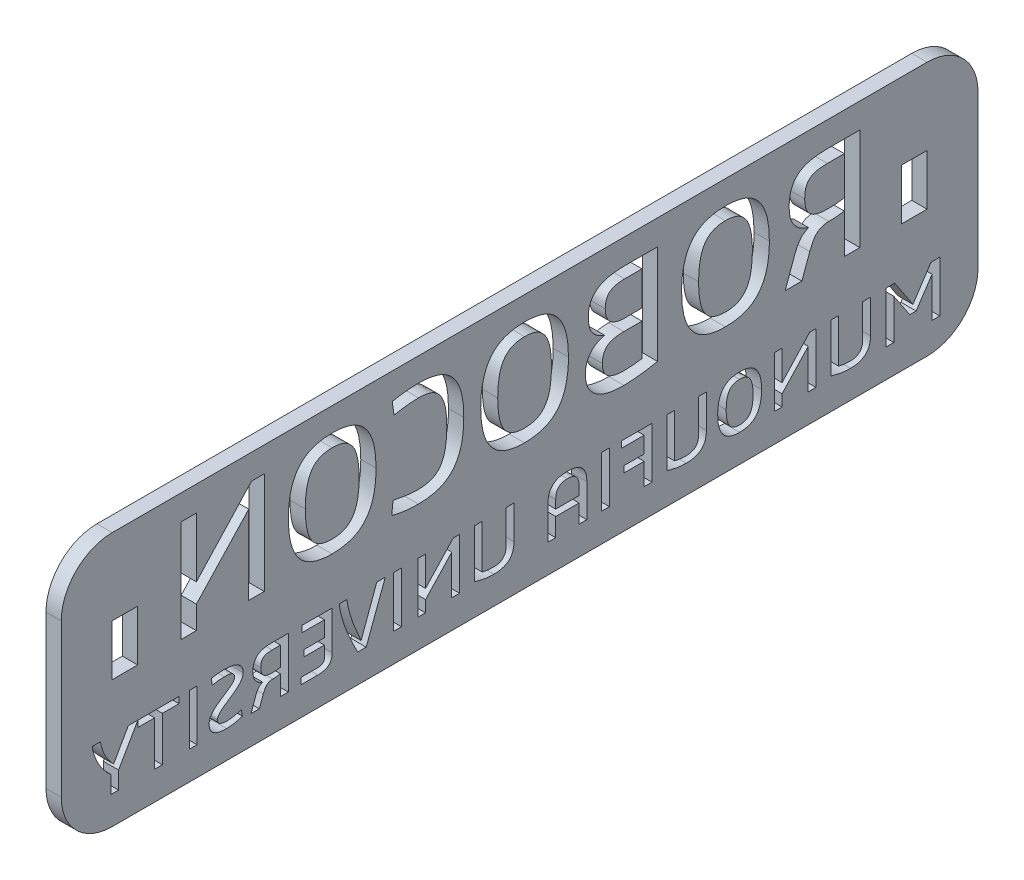
from build123d import *

# Parameters (mm, degrees)
SKETCH1_W           = 180
SKETCH1_H           = 50
SKETCH1_W_2         = 5
SKETCH1_H_2         = 10
BOSS_EXTRUDE1_DEPTH = 3
FILLET1_R           = 10
SKETCH3_W           = 1.527777778
SKETCH3_H           = 10
CUT_EXTRUDE2_DEPTH  = 94.45587194


with BuildPart() as part:
    # Sketch1 → Boss-Extrude1 (new body)
    with BuildSketch(Plane(origin=(0, 0, 0), x_dir=(0, 0, -1), z_dir=(1, 0, 0))):
        Rectangle(SKETCH1_W, SKETCH1_H)
        with Locations((-77.5, 5)):
            Rectangle(SKETCH1_W_2, SKETCH1_H_2, mode=Mode.SUBTRACT)
        with Locations((77.5, 5)):
            Rectangle(SKETCH1_W_2, SKETCH1_H_2, mode=Mode.SUBTRACT)
    extrude(amount=BOSS_EXTRUDE1_DEPTH)

    # Fillet1
    fillet1_edges = [part.edges().sort_by_distance(p)[0] for p in [
        (1.5, -25, -90),
        (1.5, -25, 90),
        (1.5, 25, 90),
        (1.5, 25, -90),
    ]]
    fillet(fillet1_edges, radius=FILLET1_R)

    # Sketch3 → Cut-Extrude2 (cut, through all)
    # profile 1 of 25: a face of its own
    with BuildSketch(Plane.ZY):
        with BuildLine():
            add(Edge.make_bspline(
                [(-60.438368056, 20.06870833), (-60.137357433, 20.06583894), (-59.552131515, 20.060260261), (-58.704482852, 20.004166542), (-57.913361517, 19.908863799), (-57.179861334, 19.778120117), (-56.502000586, 19.598855943), (-55.876874569, 19.380524424), (-55.31783718, 19.086595305), (-54.808062036, 18.753825519), (-54.355610314, 18.360262554), (-53.967400045, 17.904159626), (-53.637937601, 17.390612372), (-53.374423779, 16.815356219), (-53.162667691, 16.177175541), (-53.019855449, 15.467550356), (-52.933061041, 14.684585797), (-52.922293305, 14.138687539), (-52.916666667, 13.853430552)],
                knots=[0, 0, 0, 0, 1.276316178, 2.481418438, 3.60002617, 4.65414006, 5.637770364, 6.571278879, 7.454804249, 8.308980615, 9.148131266, 9.987909621, 10.840520288, 11.727065103, 12.664114984, 13.685643338, 14.790642032, 16, 16, 16, 16], degree=3))
            add(Edge.make_bspline(
                [(-52.916666667, 13.853430552), (-52.919390792, 13.659404319), (-52.924688858, 13.282048692), (-52.982853715, 12.736720494), (-53.071608548, 12.227867756), (-53.20261392, 11.759439307), (-53.363835197, 11.327372835), (-53.551237841, 10.929548756), (-53.764330802, 10.563314086), (-54.003288652, 10.226877149), (-54.270766976, 9.923162037), (-54.556506445, 9.642116776), (-54.873451853, 9.394492), (-55.32565682, 9.093582185), (-55.944439374, 8.772338945), (-56.469050826, 8.578727227), (-56.736111111, 8.480166663)],
                knots=[0, 0, 0, 0, 1.140532232, 2.218185918, 3.22111422, 4.174729766, 5.073887625, 5.930164235, 6.757508103, 7.562548926, 8.352478149, 9.134626443, 9.915895112, 10.713438617, 12.326933167, 14, 14, 14, 14], degree=3))
            add(Edge.make_bspline(
                [(-56.736111111, 8.480166663), (-56.558338163, 8.407436481), (-56.212322662, 8.265875179), (-55.750702542, 7.968718643), (-55.345507642, 7.629397919), (-55.012047358, 7.21952015), (-54.715373423, 6.754240016), (-54.435083298, 6.225680988), (-54.159306323, 5.629904194), (-53.998840351, 5.201553028), (-53.914930556, 4.977562496)],
                knots=[0, 0, 0, 0, 0.986219143, 1.919567142, 2.811641567, 3.694100688, 4.625190488, 5.647513622, 6.769853527, 8, 8, 8, 8], degree=3))
            Line((-53.914930556, 4.977562496), (-52.144097222, 0.06870833))
            Line((-52.144097222, 0.06870833), (-55.416666667, 0.06870833))
            Line((-55.416666667, 0.06870833), (-56.974826389, 4.317840274))
            add(Edge.make_bspline(
                [(-56.974826389, 4.317840274), (-57.065134817, 4.547390723), (-57.23910198, 4.989589098), (-57.528054916, 5.614869322), (-57.84866811, 6.178345415), (-58.181744877, 6.580432305), (-58.476636269, 6.859873212), (-58.718621518, 7.047185518), (-58.987631263, 7.200403613), (-59.278456425, 7.331566292), (-59.591852814, 7.444120015), (-59.938412783, 7.512851776), (-60.312388758, 7.564636225), (-60.572708751, 7.567319377), (-60.707465278, 7.56870833)],
                knots=[0, 0, 0, 0, 1.653123621, 3.184522542, 4.614822378, 5.985597255, 6.664764969, 7.335853698, 8.031100638, 8.734149007, 9.473257537, 10.256893064, 11.097668087, 12, 12, 12, 12], degree=3))
            add(Edge.make_bspline(
                [(-60.707465278, 7.56870833), (-60.949082459, 7.572301476), (-61.441162078, 7.579619308), (-62.191744727, 7.604967442), (-62.96606871, 7.67798993), (-63.485681915, 7.763782459), (-63.75, 7.807423607)],
                knots=[0, 0, 0, 0, 0.948870968, 1.932478739, 2.948288351, 4, 4, 4, 4], degree=3))
            Line((-63.75, 7.807423607), (-63.75, 0.06870833))
            Line((-63.75, 0.06870833), (-66.805555556, 0.06870833))
            Line((-66.805555556, 0.06870833), (-66.805555556, 20.06870833))
            Line((-66.805555556, 20.06870833), (-60.438368056, 20.06870833))
        make_face()
        with BuildLine():
            add(Edge.make_bspline(
                [(-63.75, 10.060027774), (-63.465362059, 10.015298647), (-62.910617197, 9.928123855), (-62.091937804, 9.846732775), (-61.311232542, 9.804029201), (-60.802996711, 9.795219613), (-60.555555556, 9.790930552)],
                knots=[0, 0, 0, 0, 1.077206967, 2.099421561, 3.074678925, 4, 4, 4, 4], degree=3))
            add(Edge.make_bspline(
                [(-60.555555556, 9.790930552), (-60.351430043, 9.792283154), (-59.959916082, 9.794877452), (-59.396527767, 9.846250171), (-58.879683864, 9.916310659), (-58.409051608, 10.019831192), (-57.985238915, 10.152847972), (-57.608347286, 10.318883203), (-57.275589142, 10.511358993), (-56.993099264, 10.742666129), (-56.748554256, 11.003614809), (-56.543843811, 11.300134882), (-56.360103209, 11.624683782), (-56.221256962, 11.987138191), (-56.105188098, 12.381309051), (-56.031745104, 12.809593971), (-55.981801851, 13.270659693), (-55.975496723, 13.588524492), (-55.972222222, 13.753604163)],
                knots=[0, 0, 0, 0, 1.393128065, 2.672028008, 3.859456794, 4.952316362, 5.9582354, 6.886987444, 7.759454001, 8.574023428, 9.370789219, 10.19298944, 11.028667804, 11.910976715, 12.836360653, 13.830325822, 14.873203013, 16, 16, 16, 16], degree=3))
            add(Edge.make_bspline(
                [(-55.972222222, 13.753604163), (-55.975514246, 13.936018739), (-55.981797095, 14.284158121), (-56.029785232, 14.780251413), (-56.104435879, 15.225679662), (-56.218022845, 15.623352871), (-56.36683818, 15.976341505), (-56.543188527, 16.296665317), (-56.767915463, 16.569537299), (-57.024708864, 16.808993806), (-57.315853059, 17.01402972), (-57.648981843, 17.179632439), (-58.017350377, 17.313552673), (-58.425625, 17.411145195), (-58.869754892, 17.483447572), (-59.353722488, 17.534819801), (-59.879522629, 17.565164933), (-60.244459892, 17.567496954), (-60.434027778, 17.56870833)],
                knots=[0, 0, 0, 0, 1.269903941, 2.423619773, 3.466996091, 4.41068728, 5.295611013, 6.130256143, 6.94677135, 7.745062684, 8.569493401, 9.416448884, 10.327866593, 11.292929492, 12.334602417, 13.459279211, 14.680214062, 16, 16, 16, 16], degree=3))
            Line((-60.434027778, 17.56870833), (-63.75, 17.56870833))
            Line((-63.75, 17.56870833), (-63.75, 10.060027774))
        make_face(mode=Mode.SUBTRACT)
    # profile 2 of 25: a face of its own
    with BuildSketch(Plane.ZY):
        with BuildLine():
            add(Edge.make_bspline(
                [(-31.805555556, 10.06870833), (-31.811797186, 9.625801701), (-31.823809728, 8.773390605), (-31.926917957, 7.543321417), (-32.103725429, 6.415123097), (-32.342682084, 5.382558168), (-32.658664492, 4.448819901), (-33.027312817, 3.597069623), (-33.478777743, 2.84018915), (-33.985481356, 2.161745387), (-34.570651518, 1.582171983), (-35.214715979, 1.078581434), (-35.930251883, 0.667006329), (-36.711410964, 0.340198157), (-37.552821789, 0.096369066), (-38.451757785, -0.080518892), (-39.408389708, -0.191589873), (-40.066239215, -0.203143612), (-40.403645833, -0.209069448)],
                knots=[0, 0, 0, 0, 1.379190214, 2.65436768, 3.840304207, 4.93315577, 5.950468051, 6.906593746, 7.817631495, 8.689034797, 9.536498313, 10.374652267, 11.228594673, 12.098879028, 13.005594778, 13.951956918, 14.949572383, 16, 16, 16, 16], degree=3))
            add(Edge.make_bspline(
                [(-40.403645833, -0.209069448), (-40.745406387, -0.20328408), (-41.40906173, -0.192049635), (-42.374166981, -0.079859453), (-43.277923653, 0.095031902), (-44.121726613, 0.34059139), (-44.902540335, 0.665514518), (-45.615258739, 1.081387429), (-46.262555714, 1.580442982), (-46.847585085, 2.162033853), (-47.354929756, 2.839975302), (-47.805020416, 3.598166375), (-48.180311625, 4.447615373), (-48.494235412, 5.382798611), (-48.735436224, 6.414629219), (-48.904717611, 7.543822015), (-49.010007883, 8.773312033), (-49.021701736, 9.625774835), (-49.027777778, 10.06870833)],
                knots=[0, 0, 0, 0, 1.062102096, 2.062466616, 3.016021238, 3.921173563, 4.789957311, 5.638538267, 6.478805827, 7.324808085, 8.19470885, 9.104175723, 10.060484452, 11.07604261, 12.167009799, 13.350209172, 14.623187885, 16, 16, 16, 16], degree=3))
            add(Edge.make_bspline(
                [(-49.027777778, 10.06870833), (-49.021616308, 10.511633146), (-49.009737984, 11.365521023), (-48.905434912, 12.595132156), (-48.734912189, 13.72415874), (-48.494257816, 14.754603189), (-48.180390722, 15.689873549), (-47.804711073, 16.538997136), (-47.356600082, 17.297328746), (-46.84459872, 17.971303339), (-46.264309746, 18.557236921), (-45.615005356, 19.05578926), (-44.902610216, 19.471968324), (-44.121706856, 19.796806558), (-43.277929347, 20.04239015), (-42.374165348, 20.217274565), (-41.409062177, 20.329466717), (-40.745406538, 20.340700883), (-40.403645833, 20.346486107)],
                knots=[0, 0, 0, 0, 1.376842614, 2.65433133, 3.833111465, 4.924102822, 5.939683476, 6.896013389, 7.805500408, 8.671843172, 9.521050656, 10.361336829, 11.209936583, 12.078739576, 12.983911952, 13.937487697, 14.937874376, 16, 16, 16, 16], degree=3))
            add(Edge.make_bspline(
                [(-40.403645833, 20.346486107), (-40.066239066, 20.340560413), (-39.408389268, 20.329006949), (-38.451759407, 20.217934014), (-37.552816146, 20.041052941), (-36.711430749, 19.797199755), (-35.930181789, 19.470476748), (-35.214970487, 19.058594069), (-34.568905165, 18.555499421), (-33.988468564, 17.971590673), (-33.477105635, 17.297115865), (-33.027621271, 16.540094494), (-32.658585867, 15.688668842), (-32.342658071, 14.754844102), (-32.104252875, 13.723662794), (-31.92618824, 12.595636579), (-31.824082511, 11.36544171), (-31.811883415, 10.511606057), (-31.805555556, 10.06870833)],
                knots=[0, 0, 0, 0, 1.050450755, 2.048088194, 2.994471179, 3.901206901, 4.771510425, 5.62547164, 6.463644057, 7.314318229, 8.182157275, 9.093215091, 10.049361846, 11.066696535, 12.15957217, 13.341084308, 14.620779407, 16, 16, 16, 16], degree=3))
        make_face()
        with BuildLine():
            add(Edge.make_bspline(
                [(-35.138888889, 10.06870833), (-35.143133254, 10.417459936), (-35.151276719, 11.086593222), (-35.210537102, 12.048719937), (-35.313320154, 12.92395114), (-35.453605367, 13.716733456), (-35.641524938, 14.428764621), (-35.863802515, 15.070024775), (-36.131928974, 15.639423159), (-36.447656847, 16.13504779), (-36.800563751, 16.565158927), (-37.194863533, 16.930980746), (-37.633650793, 17.229793095), (-38.116884711, 17.459556361), (-38.637129755, 17.630917464), (-39.191920775, 17.758157536), (-39.785374361, 17.831321485), (-40.193665244, 17.841335819), (-40.403645833, 17.846486107)],
                knots=[0, 0, 0, 0, 1.553284214, 2.980213282, 4.291011016, 5.476560744, 6.562829263, 7.567583194, 8.495665922, 9.359059779, 10.17833212, 10.967240861, 11.746484971, 12.533285595, 13.342255422, 14.181679379, 15.064852897, 16, 16, 16, 16], degree=3))
            add(Edge.make_bspline(
                [(-40.403645833, 17.846486107), (-40.616524436, 17.841400479), (-41.02915538, 17.831542807), (-41.628315822, 17.75797982), (-42.184906576, 17.632083792), (-42.70266898, 17.460645775), (-43.179782966, 17.227487486), (-43.617233198, 16.930004011), (-44.015385548, 16.565442332), (-44.372563924, 16.135246353), (-44.692799656, 15.63972258), (-44.964998676, 15.070206761), (-45.192882339, 14.429633917), (-45.379364138, 13.716612509), (-45.520125797, 12.923988577), (-45.622761931, 12.048708535), (-45.68206641, 11.086596478), (-45.690203435, 10.417461052), (-45.694444444, 10.06870833)],
                knots=[0, 0, 0, 0, 0.946534936, 1.834705785, 2.679084872, 3.480688493, 4.254681674, 5.032701998, 5.825113268, 6.647212702, 7.512724805, 8.442137655, 9.447477506, 10.532040066, 11.715727916, 13.024467073, 14.449155182, 16, 16, 16, 16], degree=3))
            add(Edge.make_bspline(
                [(-45.694444444, 10.06870833), (-45.69020325, 9.719955713), (-45.682065871, 9.05082049), (-45.622763819, 8.088707041), (-45.520119596, 7.213431638), (-45.379384169, 6.420792662), (-45.192816367, 5.707820575), (-44.965218448, 5.067083865), (-44.691540031, 4.497014303), (-44.373670563, 3.998726134), (-44.016921963, 3.567222476), (-43.614338007, 3.20825604), (-43.181440864, 2.904604853), (-42.702339523, 2.673136873), (-42.185595977, 2.4995619), (-41.627628373, 2.381016544), (-41.029258452, 2.305428799), (-40.616559515, 2.295864716), (-40.403645833, 2.290930552)],
                knots=[0, 0, 0, 0, 1.550522364, 2.97491425, 4.283381292, 5.466823028, 6.551160084, 7.556290903, 8.485510509, 9.356252596, 10.178181097, 10.966107302, 11.747600919, 12.52143317, 13.32287012, 14.16567569, 15.053661868, 16, 16, 16, 16], degree=3))
            add(Edge.make_bspline(
                [(-40.403645833, 2.290930552), (-40.193630335, 2.295931191), (-39.785271574, 2.305654544), (-39.192612313, 2.380834203), (-38.636430935, 2.50070734), (-38.117221376, 2.674242066), (-37.631972477, 2.902271006), (-37.197759075, 3.207258981), (-36.799026664, 3.567523055), (-36.44655812, 3.998939142), (-36.133180697, 4.497297481), (-35.863583567, 5.067268309), (-35.641590843, 5.708689234), (-35.453585339, 6.4206719), (-35.313326354, 7.213469018), (-35.210535214, 8.088695656), (-35.151277258, 9.050823742), (-35.143133439, 9.719956827), (-35.138888889, 10.06870833)],
                knots=[0, 0, 0, 0, 0.934953236, 1.817943662, 2.655782946, 3.464585063, 4.251222575, 5.033945916, 5.818337812, 6.637440309, 7.50609533, 8.433985656, 9.438531289, 10.524574612, 11.709878561, 13.020404551, 14.4470378, 16, 16, 16, 16], degree=3))
        make_face(mode=Mode.SUBTRACT)
    # profile 3 of 25: a face of its own
    with BuildSketch(Plane.ZY):
        with BuildLine():
            add(Edge.make_bspline(
                [(-20.607638889, 20.06870833), (-20.339882828, 20.065654319), (-19.815421275, 20.05967234), (-19.04953218, 20.004872299), (-18.321316766, 19.926814937), (-17.636352512, 19.803185707), (-16.992051371, 19.653486004), (-16.401856641, 19.447626063), (-15.861047203, 19.206175857), (-15.376356146, 18.91364933), (-14.943231943, 18.576203241), (-14.556190806, 18.198643017), (-14.230430247, 17.767829201), (-13.952275257, 17.294643532), (-13.73513509, 16.768984471), (-13.57805573, 16.188996795), (-13.488559825, 15.553276814), (-13.477793166, 15.110948378), (-13.472222222, 14.882076385)],
                knots=[0, 0, 0, 0, 1.275017476, 2.497413668, 3.655529886, 4.761172243, 5.810683038, 6.802155223, 7.733376211, 8.626736769, 9.490922873, 10.343577315, 11.193889908, 12.055407364, 12.951156235, 13.893904713, 14.910252681, 16, 16, 16, 16], degree=3))
            add(Edge.make_bspline(
                [(-13.472222222, 14.882076385), (-13.474626746, 14.717075601), (-13.479274324, 14.398154309), (-13.517720434, 13.933854014), (-13.587199169, 13.500309201), (-13.681937217, 13.095262469), (-13.802717185, 12.720065396), (-13.952062165, 12.374939719), (-14.122240751, 12.055574501), (-14.399245117, 11.681155647), (-14.796000004, 11.258668319), (-15.351269187, 10.827877461), (-15.985286558, 10.470425661), (-16.446886349, 10.299664184), (-16.684027778, 10.211937496)],
                knots=[0, 0, 0, 0, 0.966624788, 1.868337948, 2.726741993, 3.536787614, 4.303406302, 5.032411389, 5.737978016, 6.417875256, 7.755106372, 9.120016348, 10.520442492, 12, 12, 12, 12], degree=3))
            add(Edge.make_bspline(
                [(-16.684027778, 10.211937496), (-16.443316226, 10.145449898), (-15.957495615, 10.011260055), (-15.379761893, 9.753732582), (-14.931549653, 9.514045016), (-14.616124927, 9.303439468), (-14.32632803, 9.059429934), (-14.055912762, 8.791968549), (-13.812756509, 8.488939388), (-13.590325046, 8.158839457), (-13.394014577, 7.795545191), (-13.225766368, 7.400418919), (-13.083367836, 6.970509211), (-12.985376217, 6.501880641), (-12.930364481, 5.994500543), (-12.921336806, 5.644653999), (-12.916666667, 5.463673607)],
                knots=[0, 0, 0, 0, 1.581382182, 3.191654296, 3.996150086, 4.802578193, 5.590591429, 6.394825738, 7.209918391, 8.04941736, 8.915406058, 9.823505186, 10.769092598, 11.781910097, 12.852551823, 14, 14, 14, 14], degree=3))
            add(Edge.make_bspline(
                [(-12.916666667, 5.463673607), (-12.922554984, 5.239149081), (-12.933998216, 4.802812791), (-13.020927912, 4.169606481), (-13.168377895, 3.578300323), (-13.377076735, 3.026837914), (-13.648844859, 2.516483258), (-13.974885773, 2.043058542), (-14.365023165, 1.616086638), (-14.813010311, 1.231059884), (-15.317559514, 0.887820673), (-15.882558712, 0.591261991), (-16.507819632, 0.345325323), (-17.190732994, 0.143208524), (-17.931792541, -0.018279977), (-18.732927511, -0.127091081), (-19.592147077, -0.198900729), (-20.185028626, -0.205612092), (-20.490451389, -0.209069448)],
                knots=[0, 0, 0, 0, 1.000984783, 1.945292987, 2.843427608, 3.713289463, 4.567532532, 5.41581069, 6.269858848, 7.138954811, 8.044381704, 8.985157295, 9.97829437, 11.035574772, 12.157986986, 13.356835235, 14.638374414, 16, 16, 16, 16], degree=3))
            add(Edge.make_bspline(
                [(-20.490451389, -0.209069448), (-20.710406739, -0.206282193), (-21.173771828, -0.200410471), (-21.901783716, -0.158641963), (-22.697657716, -0.092783663), (-23.845580275, 0.028462613), (-25.318675329, 0.237024192), (-26.49530805, 0.460498621), (-27.083333333, 0.572180552)],
                knots=[0, 0, 0, 0, 0.595515751, 1.254532835, 1.973766876, 2.757598848, 4.379601532, 6, 6, 6, 6], degree=3))
            Line((-27.083333333, 0.572180552), (-27.083333333, 20.06870833))
            Line((-27.083333333, 20.06870833), (-20.607638889, 20.06870833))
        make_face()
        with BuildLine():
            add(Edge.make_bspline(
                [(-24.027777778, 2.581729163), (-23.724265387, 2.537461396), (-23.114320227, 2.448499919), (-22.350509934, 2.372633694), (-21.752034233, 2.335769045), (-21.334239021, 2.306177253), (-20.95059655, 2.294165399), (-20.706022582, 2.291969678), (-20.590277778, 2.290930552)],
                knots=[0, 0, 0, 0, 1.598930811, 3.213246439, 3.999428574, 4.724909699, 5.396562606, 6, 6, 6, 6], degree=3))
            add(Edge.make_bspline(
                [(-20.590277778, 2.290930552), (-20.391954958, 2.292597604), (-20.012146046, 2.295790182), (-19.467775075, 2.342681884), (-18.971121159, 2.403485733), (-18.521787922, 2.497593597), (-18.118750047, 2.625280263), (-17.75778723, 2.774131869), (-17.44120696, 2.953283964), (-17.168042886, 3.159003727), (-16.936636787, 3.391728665), (-16.739590332, 3.645214698), (-16.576758325, 3.919949723), (-16.454848533, 4.220688347), (-16.367640168, 4.542272621), (-16.29454443, 4.883603658), (-16.257665521, 5.247288635), (-16.252590183, 5.496883771), (-16.25, 5.624263885)],
                knots=[0, 0, 0, 0, 1.5079511, 2.887883838, 4.153187438, 5.31219721, 6.37369912, 7.364942027, 8.276706912, 9.132853101, 9.957662229, 10.765486101, 11.569478376, 12.378725068, 13.225198586, 14.101406598, 15.031058665, 16, 16, 16, 16], degree=3))
            add(Edge.make_bspline(
                [(-16.25, 5.624263885), (-16.252047425, 5.758925867), (-16.25602179, 6.020325478), (-16.299612899, 6.399635501), (-16.374025018, 6.752138794), (-16.471971286, 7.080603052), (-16.603742623, 7.380981559), (-16.759680781, 7.657911859), (-16.948161241, 7.907265205), (-17.167565743, 8.131364813), (-17.424153742, 8.331541771), (-17.726823462, 8.498897488), (-18.073293297, 8.642740959), (-18.46505399, 8.757728397), (-18.901961153, 8.848501122), (-19.383607642, 8.911569216), (-19.9110887, 8.951010669), (-20.27770216, 8.955340748), (-20.46875, 8.957597218)],
                knots=[0, 0, 0, 0, 1.039457627, 2.017747073, 2.942324498, 3.818672792, 4.659186067, 5.469768499, 6.267391952, 7.065250057, 7.88532226, 8.770737444, 9.727160389, 10.776832741, 11.918314688, 13.169583561, 14.52502702, 16, 16, 16, 16], degree=3))
            Line((-20.46875, 8.957597218), (-24.027777778, 8.957597218))
            Line((-24.027777778, 8.957597218), (-24.027777778, 2.581729163))
        make_face(mode=Mode.SUBTRACT)
        with BuildLine():
            Line((-24.027777778, 11.179819441), (-20.520833333, 11.179819441))
            add(Edge.make_bspline(
                [(-20.520833333, 11.179819441), (-20.377534018, 11.182292386), (-20.099053367, 11.187098182), (-19.692330751, 11.225124864), (-19.312960472, 11.295918988), (-18.955693688, 11.384839792), (-18.625367161, 11.50844032), (-18.316767317, 11.653218925), (-18.036040247, 11.830496365), (-17.777532619, 12.029787432), (-17.546998137, 12.25906393), (-17.349682425, 12.520546889), (-17.179420699, 12.808165809), (-17.040055006, 13.125638506), (-16.938164634, 13.473487007), (-16.858142244, 13.845938208), (-16.817202991, 14.248949327), (-16.809525364, 14.526099157), (-16.805555556, 14.669402774)],
                knots=[0, 0, 0, 0, 1.179836879, 2.292835395, 3.358283882, 4.355062049, 5.319866689, 6.257597555, 7.156623973, 8.047803328, 8.940652974, 9.824557926, 10.737756677, 11.687217154, 12.670739226, 13.717376299, 14.819742255, 16, 16, 16, 16], degree=3))
            add(Edge.make_bspline(
                [(-16.805555556, 14.669402774), (-16.807561706, 14.806962335), (-16.811437213, 15.072701678), (-16.854971033, 15.45631691), (-16.928571009, 15.809224641), (-17.028310425, 16.132058557), (-17.152499923, 16.427664167), (-17.313914281, 16.688208338), (-17.504090196, 16.917095279), (-17.718858045, 17.119632906), (-17.965238081, 17.295424746), (-18.24669669, 17.442409216), (-18.559875588, 17.566765829), (-18.906164611, 17.67317555), (-19.28622408, 17.747110952), (-19.699097528, 17.804440995), (-20.144113768, 17.838501614), (-20.452778173, 17.843769216), (-20.611979167, 17.846486107)],
                knots=[0, 0, 0, 0, 1.150697841, 2.222933009, 3.224930285, 4.163092118, 5.046954926, 5.900361047, 6.717263274, 7.53092952, 8.364087008, 9.241458692, 10.181181528, 11.180762319, 12.268199555, 13.417048986, 14.667781701, 16, 16, 16, 16], degree=3))
            Line((-20.611979167, 17.846486107), (-24.027777778, 17.846486107))
            Line((-24.027777778, 17.846486107), (-24.027777778, 11.179819441))
        make_face(mode=Mode.SUBTRACT)
    # profile 4 of 25: a face of its own
    with BuildSketch(Plane.ZY):
        with BuildLine():
            add(Edge.make_bspline(
                [(7.638888889, 10.06870833), (7.632647259, 9.625801701), (7.620634717, 8.773390605), (7.517526487, 7.543321417), (7.340719015, 6.415123097), (7.101762361, 5.382558168), (6.785779952, 4.448819901), (6.417131628, 3.597069623), (5.965666701, 2.84018915), (5.458963089, 2.161745387), (4.873792927, 1.582171983), (4.229728465, 1.078581434), (3.514192561, 0.667006329), (2.733033481, 0.340198157), (1.891622655, 0.096369066), (0.99268666, -0.080518892), (0.036054736, -0.191589873), (-0.621794771, -0.203143612), (-0.959201389, -0.209069448)],
                knots=[0, 0, 0, 0, 1.379190214, 2.65436768, 3.840304207, 4.93315577, 5.950468051, 6.906593746, 7.817631495, 8.689034797, 9.536498313, 10.374652267, 11.228594673, 12.098879028, 13.005594778, 13.951956918, 14.949572383, 16, 16, 16, 16], degree=3))
            add(Edge.make_bspline(
                [(-0.959201389, -0.209069448), (-1.300961942, -0.20328408), (-1.964617286, -0.192049635), (-2.929722537, -0.079859453), (-3.833479208, 0.095031902), (-4.677282168, 0.34059139), (-5.45809589, 0.665514518), (-6.170814294, 1.081387429), (-6.818111269, 1.580442982), (-7.40314064, 2.162033853), (-7.910485312, 2.839975302), (-8.360575972, 3.598166375), (-8.735867181, 4.447615373), (-9.049790968, 5.382798611), (-9.29099178, 6.414629219), (-9.460273167, 7.543822015), (-9.565563439, 8.773312033), (-9.577257292, 9.625774835), (-9.583333333, 10.06870833)],
                knots=[0, 0, 0, 0, 1.062102096, 2.062466616, 3.016021238, 3.921173563, 4.789957311, 5.638538267, 6.478805827, 7.324808085, 8.19470885, 9.104175723, 10.060484452, 11.07604261, 12.167009799, 13.350209172, 14.623187885, 16, 16, 16, 16], degree=3))
            add(Edge.make_bspline(
                [(-9.583333333, 10.06870833), (-9.577171863, 10.511633146), (-9.56529354, 11.365521023), (-9.460990467, 12.595132156), (-9.290467744, 13.72415874), (-9.049813372, 14.754603189), (-8.735946277, 15.689873549), (-8.360266629, 16.538997136), (-7.912155638, 17.297328746), (-7.400154276, 17.971303339), (-6.819865302, 18.557236921), (-6.170560912, 19.05578926), (-5.458165771, 19.471968324), (-4.677262412, 19.796806558), (-3.833484903, 20.04239015), (-2.929720903, 20.217274565), (-1.964617732, 20.329466717), (-1.300962094, 20.340700883), (-0.959201389, 20.346486107)],
                knots=[0, 0, 0, 0, 1.376842614, 2.65433133, 3.833111465, 4.924102822, 5.939683476, 6.896013389, 7.805500408, 8.671843172, 9.521050656, 10.361336829, 11.209936583, 12.078739576, 12.983911952, 13.937487697, 14.937874376, 16, 16, 16, 16], degree=3))
            add(Edge.make_bspline(
                [(-0.959201389, 20.346486107), (-0.621794621, 20.340560413), (0.036055176, 20.329006949), (0.992685038, 20.217934014), (1.891628298, 20.041052941), (2.733013696, 19.797199755), (3.514262655, 19.470476748), (4.229473957, 19.058594069), (4.875539279, 18.555499421), (5.455975881, 17.971590673), (5.967338809, 17.297115865), (6.416823174, 16.540094494), (6.785858578, 15.688668842), (7.101786373, 14.754844102), (7.34019157, 13.723662794), (7.518256204, 12.595636579), (7.620361933, 11.36544171), (7.63256103, 10.511606057), (7.638888889, 10.06870833)],
                knots=[0, 0, 0, 0, 1.050450755, 2.048088194, 2.994471179, 3.901206901, 4.771510425, 5.62547164, 6.463644057, 7.314318229, 8.182157275, 9.093215091, 10.049361846, 11.066696535, 12.15957217, 13.341084308, 14.620779407, 16, 16, 16, 16], degree=3))
        make_face()
        with BuildLine():
            add(Edge.make_bspline(
                [(4.305555556, 10.06870833), (4.30131119, 10.417459936), (4.293167726, 11.086593222), (4.233907343, 12.048719937), (4.13112429, 12.92395114), (3.990839077, 13.716733456), (3.802919506, 14.428764621), (3.58064193, 15.070024775), (3.31251547, 15.639423159), (2.996787597, 16.13504779), (2.643880694, 16.565158927), (2.249580911, 16.930980746), (1.810793651, 17.229793095), (1.327559734, 17.459556361), (0.80731469, 17.630917464), (0.252523669, 17.758157536), (-0.340929916, 17.831321485), (-0.749220799, 17.841335819), (-0.959201389, 17.846486107)],
                knots=[0, 0, 0, 0, 1.553284214, 2.980213282, 4.291011016, 5.476560744, 6.562829263, 7.567583194, 8.495665922, 9.359059779, 10.17833212, 10.967240861, 11.746484971, 12.533285595, 13.342255422, 14.181679379, 15.064852897, 16, 16, 16, 16], degree=3))
            add(Edge.make_bspline(
                [(-0.959201389, 17.846486107), (-1.172079992, 17.841400479), (-1.584710936, 17.831542807), (-2.183871378, 17.75797982), (-2.740462132, 17.632083792), (-3.258224536, 17.460645775), (-3.735338522, 17.227487486), (-4.172788754, 16.930004011), (-4.570941104, 16.565442332), (-4.92811948, 16.135246353), (-5.248355212, 15.63972258), (-5.520554231, 15.070206761), (-5.748437894, 14.429633917), (-5.934919694, 13.716612509), (-6.075681352, 12.923988577), (-6.178317487, 12.048708535), (-6.237621966, 11.086596478), (-6.245758991, 10.417461052), (-6.25, 10.06870833)],
                knots=[0, 0, 0, 0, 0.946534936, 1.834705785, 2.679084872, 3.480688493, 4.254681674, 5.032701998, 5.825113268, 6.647212702, 7.512724805, 8.442137655, 9.447477506, 10.532040066, 11.715727916, 13.024467073, 14.449155182, 16, 16, 16, 16], degree=3))
            add(Edge.make_bspline(
                [(-6.25, 10.06870833), (-6.245758806, 9.719955713), (-6.237621427, 9.05082049), (-6.178319375, 8.088707041), (-6.075675152, 7.213431638), (-5.934939725, 6.420792662), (-5.748371923, 5.707820575), (-5.520774004, 5.067083865), (-5.247095587, 4.497014303), (-4.929226119, 3.998726134), (-4.572477519, 3.567222476), (-4.169893563, 3.20825604), (-3.73699642, 2.904604853), (-3.257895079, 2.673136873), (-2.741151533, 2.4995619), (-2.183183928, 2.381016544), (-1.584814008, 2.305428799), (-1.17211507, 2.295864716), (-0.959201389, 2.290930552)],
                knots=[0, 0, 0, 0, 1.550522364, 2.97491425, 4.283381292, 5.466823028, 6.551160084, 7.556290903, 8.485510509, 9.356252596, 10.178181097, 10.966107302, 11.747600919, 12.52143317, 13.32287012, 14.16567569, 15.053661868, 16, 16, 16, 16], degree=3))
            add(Edge.make_bspline(
                [(-0.959201389, 2.290930552), (-0.74918589, 2.295931191), (-0.340827129, 2.305654544), (0.251832131, 2.380834203), (0.80801351, 2.50070734), (1.327223068, 2.674242066), (1.812471968, 2.902271006), (2.246685369, 3.207258981), (2.64541778, 3.567523055), (2.997886324, 3.998939142), (3.311263747, 4.497297481), (3.580860878, 5.067268309), (3.802853602, 5.708689234), (3.990859105, 6.4206719), (4.131118091, 7.213469018), (4.233909231, 8.088695656), (4.293167186, 9.050823742), (4.301311005, 9.719956827), (4.305555556, 10.06870833)],
                knots=[0, 0, 0, 0, 0.934953236, 1.817943662, 2.655782946, 3.464585063, 4.251222575, 5.033945916, 5.818337812, 6.637440309, 7.50609533, 8.433985656, 9.438531289, 10.524574612, 11.709878561, 13.020404551, 14.4470378, 16, 16, 16, 16], degree=3))
        make_face(mode=Mode.SUBTRACT)
    # profile 5 of 25: a face of its own
    with BuildSketch(Plane.ZY):
        with BuildLine():
            add(Edge.make_bspline(
                [(24.657118056, 17.303951385), (24.476451651, 17.34244362), (24.105937025, 17.421384341), (23.533037579, 17.525710251), (22.927650221, 17.615463844), (22.094214386, 17.724053244), (21.066940436, 17.820484374), (20.250510507, 17.838026207), (19.856770833, 17.846486107)],
                knots=[0, 0, 0, 0, 0.687074579, 1.409067616, 2.165573316, 2.963222243, 4.535453145, 6, 6, 6, 6], degree=3))
            add(Edge.make_bspline(
                [(19.856770833, 17.846486107), (19.629448455, 17.842924741), (19.189572892, 17.83603339), (18.552003247, 17.765927844), (17.961200282, 17.648939447), (17.413051569, 17.491701051), (16.909800166, 17.274121658), (16.455328444, 16.986501516), (16.036007687, 16.643467766), (15.672063654, 16.22214733), (15.339721282, 15.741080586), (15.066740679, 15.17792438), (14.826432819, 14.545227174), (14.633835558, 13.83262286), (14.480951499, 13.036435789), (14.383431408, 12.149648643), (14.315958037, 11.170734374), (14.309126896, 10.486954445), (14.305555556, 10.129472218)],
                knots=[0, 0, 0, 0, 0.991752626, 1.919070828, 2.79449141, 3.617551201, 4.403498422, 5.177821021, 5.95791371, 6.75855891, 7.599134358, 8.502676795, 9.481808513, 10.549439167, 11.719586718, 13.01646326, 14.440197919, 16, 16, 16, 16], degree=3))
            add(Edge.make_bspline(
                [(14.305555556, 10.129472218), (14.308855094, 9.757526062), (14.315152519, 9.047637845), (14.385703658, 8.033580315), (14.495171634, 7.120117373), (14.649157945, 6.30429106), (14.848590073, 5.577345984), (15.094605482, 4.934779787), (15.380481742, 4.367825404), (15.711793843, 3.87752045), (16.095274738, 3.465637093), (16.518285617, 3.117268113), (16.99052547, 2.843097844), (17.503687891, 2.62659259), (18.065298598, 2.48219633), (18.663521858, 2.36678561), (19.307067075, 2.302714986), (19.749579592, 2.294946043), (19.978298611, 2.290930552)],
                knots=[0, 0, 0, 0, 1.590943509, 3.036439637, 4.346110322, 5.524756088, 6.584929517, 7.566529077, 8.463375507, 9.295987673, 10.088721841, 10.862999325, 11.631516328, 12.416602778, 13.237912202, 14.107058561, 15.021605736, 16, 16, 16, 16], degree=3))
            add(Edge.make_bspline(
                [(19.978298611, 2.290930552), (20.170759353, 2.293931006), (20.564644906, 2.300071663), (21.16559673, 2.335173109), (21.788171737, 2.396105281), (22.630799093, 2.513454184), (23.660381145, 2.683915785), (24.472282811, 2.84315717), (24.865451389, 2.92027083)],
                knots=[0, 0, 0, 0, 0.701932299, 1.436557857, 2.194682431, 2.982679332, 4.538843155, 6, 6, 6, 6], degree=3))
            Line((24.865451389, 2.92027083), (25.108506944, 0.454993052))
            add(Edge.make_bspline(
                [(25.108506944, 0.454993052), (24.694827882, 0.347852618), (23.844289792, 0.127568275), (22.526667289, -0.065557864), (21.198705251, -0.184326951), (20.317086167, -0.200958735), (19.887152778, -0.209069448)],
                knots=[0, 0, 0, 0, 0.970818791, 1.996036144, 3.022740108, 4, 4, 4, 4], degree=3))
            add(Edge.make_bspline(
                [(19.887152778, -0.209069448), (19.551285079, -0.203744212), (18.894039336, -0.193323476), (17.93477818, -0.097230128), (17.028411954, 0.064232161), (16.172682392, 0.280754013), (15.371782255, 0.578811829), (14.633115818, 0.969978711), (13.950300079, 1.439135596), (13.332657466, 2.000956298), (12.780474413, 2.655502309), (12.297760807, 3.406606576), (11.890730595, 4.256534614), (11.614589021, 5.029943918), (11.424451226, 5.697146388), (11.306531757, 6.238568218), (11.200157696, 6.808407348), (11.120021328, 7.408402457), (11.054651982, 8.038016266), (11.008044508, 8.698090535), (10.975720969, 9.388409209), (10.973404755, 9.858888977), (10.972222222, 10.099090274)],
                knots=[0, 0, 0, 0, 1.280481253, 2.505721323, 3.671230464, 4.788529929, 5.867485009, 6.921209232, 7.967949411, 9.018535112, 10.095047436, 11.224376661, 12.4136545, 13.68059934, 14.35124864, 15.057938243, 15.792668166, 16.56116922, 17.365374855, 18.206122202, 19.084143882, 20, 20, 20, 20], degree=3))
            add(Edge.make_bspline(
                [(10.972222222, 10.099090274), (10.973375805, 10.339292765), (10.975628374, 10.808329383), (11.008199347, 11.497189348), (11.054638192, 12.155824765), (11.120026384, 12.785437001), (11.200150839, 13.385435293), (11.306553041, 13.955263871), (11.424377357, 14.496722507), (11.615320621, 15.165066988), (11.888614458, 15.93965628), (12.298200745, 16.787117996), (12.779126766, 17.533885083), (13.334604506, 18.181377157), (13.953781396, 18.737818089), (14.643338176, 19.19895291), (15.390937433, 19.581575551), (16.205697417, 19.86920576), (17.077743368, 20.082492514), (18.003142888, 20.238615917), (18.985418392, 20.330039979), (19.658369401, 20.34090189), (20.004340278, 20.346486107)],
                knots=[0, 0, 0, 0, 0.91115697, 1.779190471, 2.615624044, 3.415703396, 4.180261364, 4.911221475, 5.614285138, 6.281493417, 7.547101317, 8.725340309, 9.844267465, 10.90689815, 11.952496837, 12.992201689, 14.045221408, 15.130293649, 16.261776719, 17.447406856, 18.687686214, 20, 20, 20, 20], degree=3))
            add(Edge.make_bspline(
                [(20.004340278, 20.346486107), (20.438701154, 20.339617092), (21.311996502, 20.325806735), (22.602959698, 20.194503605), (23.841010399, 20.028531121), (24.637371179, 19.879434372), (25.017361111, 19.808291663)],
                knots=[0, 0, 0, 0, 1.031974622, 2.074815404, 3.081382731, 4, 4, 4, 4], degree=3))
            Line((25.017361111, 19.808291663), (24.657118056, 17.303951385))
        make_face()
    # profile 6 of 25: a face of its own
    with BuildSketch(Plane.ZY):
        with BuildLine():
            add(Edge.make_bspline(
                [(45.416666667, 10.06870833), (45.410425037, 9.625801701), (45.398412494, 8.773390605), (45.295304265, 7.543321417), (45.118496793, 6.415123097), (44.879540138, 5.382558168), (44.56355773, 4.448819901), (44.194909405, 3.597069623), (43.743444479, 2.84018915), (43.236740867, 2.161745387), (42.651570704, 1.582171983), (42.007506243, 1.078581434), (41.291970339, 0.667006329), (40.510811258, 0.340198157), (39.669400433, 0.096369066), (38.770464438, -0.080518892), (37.813832514, -0.191589873), (37.155983007, -0.203143612), (36.818576389, -0.209069448)],
                knots=[0, 0, 0, 0, 1.379190214, 2.65436768, 3.840304207, 4.93315577, 5.950468051, 6.906593746, 7.817631495, 8.689034797, 9.536498313, 10.374652267, 11.228594673, 12.098879028, 13.005594778, 13.951956918, 14.949572383, 16, 16, 16, 16], degree=3))
            add(Edge.make_bspline(
                [(36.818576389, -0.209069448), (36.476815836, -0.20328408), (35.813160492, -0.192049635), (34.848055241, -0.079859453), (33.944298569, 0.095031902), (33.100495609, 0.34059139), (32.319681887, 0.665514518), (31.606963484, 1.081387429), (30.959666509, 1.580442982), (30.374637137, 2.162033853), (29.867292466, 2.839975302), (29.417201806, 3.598166375), (29.041910597, 4.447615373), (28.72798681, 5.382798611), (28.486785998, 6.414629219), (28.317504611, 7.543822015), (28.212214339, 8.773312033), (28.200520486, 9.625774835), (28.194444444, 10.06870833)],
                knots=[0, 0, 0, 0, 1.062102096, 2.062466616, 3.016021238, 3.921173563, 4.789957311, 5.638538267, 6.478805827, 7.324808085, 8.19470885, 9.104175723, 10.060484452, 11.07604261, 12.167009799, 13.350209172, 14.623187885, 16, 16, 16, 16], degree=3))
            add(Edge.make_bspline(
                [(28.194444444, 10.06870833), (28.200605914, 10.511633146), (28.212484238, 11.365521023), (28.316787311, 12.595132156), (28.487310033, 13.72415874), (28.727964406, 14.754603189), (29.041831501, 15.689873549), (29.417511149, 16.538997136), (29.86562214, 17.297328746), (30.377623502, 17.971303339), (30.957912476, 18.557236921), (31.607216866, 19.05578926), (32.319612006, 19.471968324), (33.100515366, 19.796806558), (33.944292875, 20.04239015), (34.848056875, 20.217274565), (35.813160045, 20.329466717), (36.476815684, 20.340700883), (36.818576389, 20.346486107)],
                knots=[0, 0, 0, 0, 1.376842614, 2.65433133, 3.833111465, 4.924102822, 5.939683476, 6.896013389, 7.805500408, 8.671843172, 9.521050656, 10.361336829, 11.209936583, 12.078739576, 12.983911952, 13.937487697, 14.937874376, 16, 16, 16, 16], degree=3))
            add(Edge.make_bspline(
                [(36.818576389, 20.346486107), (37.155983156, 20.340560413), (37.813832954, 20.329006949), (38.770462816, 20.217934014), (39.669406076, 20.041052941), (40.510791473, 19.797199755), (41.292040433, 19.470476748), (42.007251735, 19.058594069), (42.653317057, 18.555499421), (43.233753659, 17.971590673), (43.745116587, 17.297115865), (44.194600952, 16.540094494), (44.563636355, 15.688668842), (44.879564151, 14.754844102), (45.117969347, 13.723662794), (45.296033982, 12.595636579), (45.398139711, 11.36544171), (45.410338807, 10.511606057), (45.416666667, 10.06870833)],
                knots=[0, 0, 0, 0, 1.050450755, 2.048088194, 2.994471179, 3.901206901, 4.771510425, 5.62547164, 6.463644057, 7.314318229, 8.182157275, 9.093215091, 10.049361846, 11.066696535, 12.15957217, 13.341084308, 14.620779407, 16, 16, 16, 16], degree=3))
        make_face()
        with BuildLine():
            add(Edge.make_bspline(
                [(42.083333333, 10.06870833), (42.079088968, 10.417459936), (42.070945503, 11.086593222), (42.01168512, 12.048719937), (41.908902068, 12.92395114), (41.768616855, 13.716733456), (41.580697284, 14.428764621), (41.358419707, 15.070024775), (41.090293248, 15.639423159), (40.774565375, 16.13504779), (40.421658471, 16.565158927), (40.027358689, 16.930980746), (39.588571429, 17.229793095), (39.105337512, 17.459556361), (38.585092468, 17.630917464), (38.030301447, 17.758157536), (37.436847861, 17.831321485), (37.028556979, 17.841335819), (36.818576389, 17.846486107)],
                knots=[0, 0, 0, 0, 1.553284214, 2.980213282, 4.291011016, 5.476560744, 6.562829263, 7.567583194, 8.495665922, 9.359059779, 10.17833212, 10.967240861, 11.746484971, 12.533285595, 13.342255422, 14.181679379, 15.064852897, 16, 16, 16, 16], degree=3))
            add(Edge.make_bspline(
                [(36.818576389, 17.846486107), (36.605697786, 17.841400479), (36.193066842, 17.831542807), (35.5939064, 17.75797982), (35.037315646, 17.632083792), (34.519553242, 17.460645775), (34.042439256, 17.227487486), (33.604989024, 16.930004011), (33.206836674, 16.565442332), (32.849658298, 16.135246353), (32.529422566, 15.63972258), (32.257223546, 15.070206761), (32.029339884, 14.429633917), (31.842858084, 13.716612509), (31.702096426, 12.923988577), (31.599460291, 12.048708535), (31.540155812, 11.086596478), (31.532018787, 10.417461052), (31.527777778, 10.06870833)],
                knots=[0, 0, 0, 0, 0.946534936, 1.834705785, 2.679084872, 3.480688493, 4.254681674, 5.032701998, 5.825113268, 6.647212702, 7.512724805, 8.442137655, 9.447477506, 10.532040066, 11.715727916, 13.024467073, 14.449155182, 16, 16, 16, 16], degree=3))
            add(Edge.make_bspline(
                [(31.527777778, 10.06870833), (31.532018972, 9.719955713), (31.540156351, 9.05082049), (31.599458403, 8.088707041), (31.702102626, 7.213431638), (31.842838053, 6.420792662), (32.029405855, 5.707820575), (32.257003774, 5.067083865), (32.530682191, 4.497014303), (32.848551659, 3.998726134), (33.205300259, 3.567222476), (33.607884215, 3.20825604), (34.040781358, 2.904604853), (34.519882699, 2.673136873), (35.036626245, 2.4995619), (35.59459385, 2.381016544), (36.19296377, 2.305428799), (36.605662708, 2.295864716), (36.818576389, 2.290930552)],
                knots=[0, 0, 0, 0, 1.550522364, 2.97491425, 4.283381292, 5.466823028, 6.551160084, 7.556290903, 8.485510509, 9.356252596, 10.178181097, 10.966107302, 11.747600919, 12.52143317, 13.32287012, 14.16567569, 15.053661868, 16, 16, 16, 16], degree=3))
            add(Edge.make_bspline(
                [(36.818576389, 2.290930552), (37.028591888, 2.295931191), (37.436950649, 2.305654544), (38.029609909, 2.380834203), (38.585791287, 2.50070734), (39.105000846, 2.674242066), (39.590249746, 2.902271006), (40.024463147, 3.207258981), (40.423195558, 3.567523055), (40.775664102, 3.998939142), (41.089041525, 4.497297481), (41.358638656, 5.067268309), (41.58063138, 5.708689234), (41.768636883, 6.4206719), (41.908895868, 7.213469018), (42.011687009, 8.088695656), (42.070944964, 9.050823742), (42.079088783, 9.719956827), (42.083333333, 10.06870833)],
                knots=[0, 0, 0, 0, 0.934953236, 1.817943662, 2.655782946, 3.464585063, 4.251222575, 5.033945916, 5.818337812, 6.637440309, 7.50609533, 8.433985656, 9.438531289, 10.524574612, 11.709878561, 13.020404551, 14.4470378, 16, 16, 16, 16], degree=3))
        make_face(mode=Mode.SUBTRACT)
    # profile 7 of 25: a face of its own
    with BuildSketch(Plane.ZY):
        Polygon((52.643229167, 20.06870833), (63.472222222, 8.367319441), (63.472222222, 20.06870833), (66.527777778, 20.06870833), (66.527777778, 0.06870833), (63.472222222, 0.06870833), (63.472222222, 4.582597218), (53.194444444, 15.589541663), (53.194444444, 0.06870833), (50.138888889, 0.06870833), (50.138888889, 20.06870833), align=None)
    # profile 8 of 25: a face of its own
    with BuildSketch(Plane.ZY):
        Polygon((-80.785590278, -9.403694441), (-77.222222222, -14.802999996), (-73.643663194, -9.403694441), (-71.944444444, -9.403694441), (-71.944444444, -19.403694441), (-73.472222222, -19.403694441), (-73.472222222, -11.539111107), (-76.6015625, -16.248312496), (-77.858072917, -16.248312496), (-80.972222222, -11.539111107), (-80.972222222, -19.403694441), (-82.5, -19.403694441), (-82.5, -9.403694441), align=None)
    # profile 9 of 25: a face of its own
    with BuildSketch(Plane.ZY):
        with BuildLine():
            Line((-67.361111111, -9.403694441), (-67.361111111, -15.970534718))
            add(Edge.make_bspline(
                [(-67.361111111, -15.970534718), (-67.359816676, -16.055276126), (-67.357286514, -16.220915457), (-67.326594911, -16.462850511), (-67.285574116, -16.69367046), (-67.221489997, -16.911227994), (-67.142032539, -17.117020922), (-67.04089463, -17.307803975), (-66.925303576, -17.488182326), (-66.791323735, -17.655312233), (-66.636167903, -17.807486707), (-66.455928351, -17.938012864), (-66.252843697, -18.049722829), (-66.024944915, -18.136747455), (-65.777122543, -18.209407871), (-65.50515205, -18.258721015), (-65.21033192, -18.285631101), (-65.005841991, -18.290214763), (-64.900173611, -18.292583329)],
                knots=[0, 0, 0, 0, 1.050176322, 2.052721428, 3.02038537, 3.954407948, 4.860618691, 5.751379621, 6.627245279, 7.514067673, 8.402204853, 9.313683922, 10.265162388, 11.267988392, 12.332624343, 13.463954956, 14.689520942, 16, 16, 16, 16], degree=3))
            add(Edge.make_bspline(
                [(-64.900173611, -18.292583329), (-64.785869595, -18.290959069), (-64.561505514, -18.287770854), (-64.232730858, -18.273845939), (-63.919290108, -18.245299563), (-63.62276405, -18.20580903), (-63.345059394, -18.160519396), (-63.089231832, -18.112033638), (-62.855470154, -18.066184451), (-62.708907336, -18.028478698), (-62.638888889, -18.010465274)],
                knots=[0, 0, 0, 0, 1.200770343, 2.356957737, 3.45558325, 4.505516479, 5.4986187, 6.410685073, 7.240725824, 8, 8, 8, 8], degree=3))
            Line((-62.638888889, -18.010465274), (-62.638888889, -9.403694441))
            Line((-62.638888889, -9.403694441), (-61.111111111, -9.403694441))
            Line((-61.111111111, -9.403694441), (-61.111111111, -18.928434024))
            add(Edge.make_bspline(
                [(-61.111111111, -18.928434024), (-61.226730154, -18.961427181), (-61.468892667, -19.030530899), (-61.851070623, -19.129772124), (-62.2679773, -19.230869383), (-62.719088495, -19.338367119), (-63.211591023, -19.430643901), (-63.74917912, -19.49733231), (-64.333203608, -19.53561481), (-64.738078432, -19.540204558), (-64.947916667, -19.542583329)],
                knots=[0, 0, 0, 0, 0.739635219, 1.549155897, 2.42879559, 3.378736131, 4.401670673, 5.509460027, 6.709204717, 8, 8, 8, 8], degree=3))
            add(Edge.make_bspline(
                [(-64.947916667, -19.542583329), (-65.120923756, -19.54007901), (-65.453909916, -19.535258955), (-65.933570239, -19.487152694), (-66.372292404, -19.408486474), (-66.771437659, -19.297761877), (-67.131745386, -19.157060832), (-67.455639433, -18.986237506), (-67.746438117, -18.791071269), (-68.002732468, -18.568328428), (-68.224114415, -18.318512342), (-68.410060141, -18.043939938), (-68.567001374, -17.747690626), (-68.68736027, -17.426997431), (-68.777080614, -17.085478678), (-68.842096453, -16.72558914), (-68.881752793, -16.347583186), (-68.886478554, -16.089266278), (-68.888888889, -15.957513885)],
                knots=[0, 0, 0, 0, 1.358071334, 2.61387531, 3.780297396, 4.853853152, 5.861129905, 6.811350455, 7.72347835, 8.60510341, 9.470179676, 10.336653287, 11.203015193, 12.096489802, 13.019586828, 13.972130183, 14.965701852, 16, 16, 16, 16], degree=3))
            Line((-68.888888889, -15.957513885), (-68.888888889, -9.403694441))
            Line((-68.888888889, -9.403694441), (-67.361111111, -9.403694441))
        make_face()
    # profile 10 of 25: a face of its own
    with BuildSketch(Plane.ZY):
        Polygon((-56.942274306, -9.403694441), (-51.527777778, -15.254388885), (-51.527777778, -9.403694441), (-50, -9.403694441), (-50, -19.403694441), (-51.527777778, -19.403694441), (-51.527777778, -17.146749996), (-56.666666667, -11.643277774), (-56.666666667, -19.403694441), (-58.194444444, -19.403694441), (-58.194444444, -9.403694441), align=None)
    # profile 11 of 25: a face of its own
    with BuildSketch(Plane.ZY):
        with BuildLine():
            add(Edge.make_bspline(
                [(-38.888888889, -14.403694441), (-38.892009704, -14.625147755), (-38.898015975, -15.051353303), (-38.94957009, -15.666387897), (-39.037973826, -16.230487057), (-39.157452153, -16.746769521), (-39.315443357, -17.213638655), (-39.499767519, -17.639513794), (-39.725499983, -18.01795403), (-39.978851789, -18.357175912), (-40.27143687, -18.646962614), (-40.593469101, -18.898757888), (-40.951237053, -19.104545441), (-41.341816593, -19.267949527), (-41.762522006, -19.389864072), (-42.211990003, -19.478308051), (-42.690305965, -19.533843542), (-43.019230719, -19.539620411), (-43.187934028, -19.542583329)],
                knots=[0, 0, 0, 0, 1.379190214, 2.65436768, 3.840304207, 4.93315577, 5.950468051, 6.906593746, 7.817631495, 8.689034797, 9.536498313, 10.374652267, 11.228594673, 12.098879028, 13.005594778, 13.951956918, 14.949572383, 16, 16, 16, 16], degree=3))
            add(Edge.make_bspline(
                [(-43.187934028, -19.542583329), (-43.358814304, -19.539690646), (-43.690641976, -19.534073423), (-44.173194602, -19.477978332), (-44.625072938, -19.390532654), (-45.046974418, -19.26775291), (-45.437381279, -19.105291346), (-45.79374048, -18.897354891), (-46.117388968, -18.647827114), (-46.409903653, -18.357031679), (-46.663575989, -18.018060954), (-46.888621319, -17.638965418), (-47.076266924, -17.214240919), (-47.233228817, -16.7466493), (-47.353829223, -16.230733996), (-47.438469917, -15.666137598), (-47.491115053, -15.051392589), (-47.496961979, -14.625161188), (-47.5, -14.403694441)],
                knots=[0, 0, 0, 0, 1.062102096, 2.062466616, 3.016021238, 3.921173563, 4.789957311, 5.638538267, 6.478805827, 7.324808085, 8.19470885, 9.104175723, 10.060484452, 11.07604261, 12.167009799, 13.350209172, 14.623187885, 16, 16, 16, 16], degree=3))
            add(Edge.make_bspline(
                [(-47.5, -14.403694441), (-47.496919265, -14.182232032), (-47.490980103, -13.755288094), (-47.438828567, -13.140482527), (-47.353567206, -12.575969235), (-47.233240019, -12.060747011), (-47.076306472, -11.593111831), (-46.888466648, -11.168550037), (-46.664411152, -10.789384232), (-46.408410471, -10.452396936), (-46.118265984, -10.159430145), (-45.793613789, -9.910153975), (-45.437416219, -9.702064444), (-45.046964539, -9.539645326), (-44.625075785, -9.41685353), (-44.173193785, -9.329411323), (-43.6906422, -9.273315247), (-43.35881438, -9.267698164), (-43.187934028, -9.264805552)],
                knots=[0, 0, 0, 0, 1.376842614, 2.65433133, 3.833111465, 4.924102822, 5.939683476, 6.896013389, 7.805500408, 8.671843172, 9.521050656, 10.361336829, 11.209936583, 12.078739576, 12.983911952, 13.937487697, 14.937874376, 16, 16, 16, 16], degree=3))
            add(Edge.make_bspline(
                [(-43.187934028, -9.264805552), (-43.019230644, -9.267768399), (-42.690305745, -9.273545131), (-42.211990814, -9.329081598), (-41.762519184, -9.417522135), (-41.341826486, -9.539448728), (-40.951202006, -9.702810231), (-40.593596355, -9.908751571), (-40.270563694, -10.160298895), (-39.980345393, -10.452253269), (-39.724663929, -10.789490673), (-39.499921746, -11.168001358), (-39.315404044, -11.593714184), (-39.157440147, -12.060626555), (-39.038237549, -12.576217208), (-38.949205231, -13.140230316), (-38.898152367, -13.75532775), (-38.892052819, -14.182245577), (-38.888888889, -14.403694441)],
                knots=[0, 0, 0, 0, 1.050450755, 2.048088194, 2.994471179, 3.901206901, 4.771510425, 5.62547164, 6.463644057, 7.314318229, 8.182157275, 9.093215091, 10.049361846, 11.066696535, 12.15957217, 13.341084308, 14.620779407, 16, 16, 16, 16], degree=3))
        make_face()
        with BuildLine():
            add(Edge.make_bspline(
                [(-40.555555556, -14.403694441), (-40.557677738, -14.229318637), (-40.561749471, -13.894751994), (-40.591379662, -13.413688637), (-40.642771188, -12.976073035), (-40.712913795, -12.579681878), (-40.80687358, -12.223666295), (-40.918012368, -11.903036218), (-41.052075598, -11.618337026), (-41.209939535, -11.37052471), (-41.386392987, -11.155469142), (-41.583542878, -10.972558232), (-41.802936508, -10.823152058), (-42.044553466, -10.708270425), (-42.304675988, -10.622589873), (-42.582071499, -10.558969837), (-42.878798291, -10.522387863), (-43.082943733, -10.517380696), (-43.187934028, -10.514805552)],
                knots=[0, 0, 0, 0, 1.553284214, 2.980213282, 4.291011016, 5.476560744, 6.562829263, 7.567583194, 8.495665922, 9.359059779, 10.17833212, 10.967240861, 11.746484971, 12.533285595, 13.342255422, 14.181679379, 15.064852897, 16, 16, 16, 16], degree=3))
            add(Edge.make_bspline(
                [(-43.187934028, -10.514805552), (-43.294373329, -10.517348366), (-43.500688801, -10.522277202), (-43.800269022, -10.559058695), (-44.078564399, -10.622006709), (-44.337445601, -10.707725718), (-44.576002594, -10.824304862), (-44.79472771, -10.9730466), (-44.993803885, -11.155327439), (-45.172393073, -11.370425429), (-45.332510939, -11.618187315), (-45.468610449, -11.902945225), (-45.58255228, -12.223231647), (-45.67579318, -12.579742351), (-45.746174009, -12.976054317), (-45.797492077, -13.413694338), (-45.827144316, -13.894750366), (-45.831212829, -14.229318079), (-45.833333333, -14.403694441)],
                knots=[0, 0, 0, 0, 0.946534936, 1.834705785, 2.679084872, 3.480688493, 4.254681674, 5.032701998, 5.825113268, 6.647212702, 7.512724805, 8.442137655, 9.447477506, 10.532040066, 11.715727916, 13.024467073, 14.449155182, 16, 16, 16, 16], degree=3))
            add(Edge.make_bspline(
                [(-45.833333333, -14.403694441), (-45.831212736, -14.578070749), (-45.827144047, -14.91263836), (-45.797493021, -15.393695085), (-45.746170909, -15.831332786), (-45.675803196, -16.227652274), (-45.582519295, -16.584138318), (-45.468720335, -16.904506673), (-45.331881127, -17.189541454), (-45.172946393, -17.438685538), (-44.994572093, -17.654437367), (-44.793280115, -17.833920585), (-44.576831543, -17.985746179), (-44.337280873, -18.101480169), (-44.0789091, -18.188267655), (-43.799925297, -18.247540333), (-43.500740337, -18.285334206), (-43.294390868, -18.290116247), (-43.187934028, -18.292583329)],
                knots=[0, 0, 0, 0, 1.550522364, 2.97491425, 4.283381292, 5.466823028, 6.551160084, 7.556290903, 8.485510509, 9.356252596, 10.178181097, 10.966107302, 11.747600919, 12.52143317, 13.32287012, 14.16567569, 15.053661868, 16, 16, 16, 16], degree=3))
            add(Edge.make_bspline(
                [(-43.187934028, -18.292583329), (-43.082926278, -18.29008301), (-42.878746898, -18.285221333), (-42.582417268, -18.247631504), (-42.304326579, -18.187694935), (-42.044721799, -18.100927572), (-41.802097349, -17.986913102), (-41.584990649, -17.834419115), (-41.385624443, -17.654287078), (-41.209390171, -17.438579034), (-41.05270146, -17.189399865), (-40.917902894, -16.904414451), (-40.806906532, -16.583703988), (-40.712903781, -16.227712655), (-40.642774288, -15.831314096), (-40.591378718, -15.393700777), (-40.56174974, -14.912636735), (-40.557677831, -14.578070192), (-40.555555556, -14.403694441)],
                knots=[0, 0, 0, 0, 0.934953236, 1.817943662, 2.655782946, 3.464585063, 4.251222575, 5.033945916, 5.818337812, 6.637440309, 7.50609533, 8.433985656, 9.438531289, 10.524574612, 11.709878561, 13.020404551, 14.4470378, 16, 16, 16, 16], degree=3))
        make_face(mode=Mode.SUBTRACT)
    # profile 12 of 25: a face of its own
    with BuildSketch(Plane.ZY):
        with BuildLine():
            Line((-35.138888889, -9.403694441), (-35.138888889, -15.970534718))
            add(Edge.make_bspline(
                [(-35.138888889, -15.970534718), (-35.137594453, -16.055276126), (-35.135064292, -16.220915457), (-35.104372688, -16.462850511), (-35.063351894, -16.69367046), (-34.999267775, -16.911227994), (-34.919810316, -17.117020922), (-34.818672408, -17.307803975), (-34.703081353, -17.488182326), (-34.569101513, -17.655312233), (-34.413945681, -17.807486707), (-34.233706129, -17.938012864), (-34.030621475, -18.049722829), (-33.802722693, -18.136747455), (-33.554900321, -18.209407871), (-33.282929828, -18.258721015), (-32.988109698, -18.285631101), (-32.783619768, -18.290214763), (-32.677951389, -18.292583329)],
                knots=[0, 0, 0, 0, 1.050176322, 2.052721428, 3.02038537, 3.954407948, 4.860618691, 5.751379621, 6.627245279, 7.514067673, 8.402204853, 9.313683922, 10.265162388, 11.267988392, 12.332624343, 13.463954956, 14.689520942, 16, 16, 16, 16], degree=3))
            add(Edge.make_bspline(
                [(-32.677951389, -18.292583329), (-32.563647373, -18.290959069), (-32.339283292, -18.287770854), (-32.010508636, -18.273845939), (-31.697067886, -18.245299563), (-31.400541828, -18.20580903), (-31.122837171, -18.160519396), (-30.86700961, -18.112033638), (-30.633247931, -18.066184451), (-30.486685113, -18.028478698), (-30.416666667, -18.010465274)],
                knots=[0, 0, 0, 0, 1.200770343, 2.356957737, 3.45558325, 4.505516479, 5.4986187, 6.410685073, 7.240725824, 8, 8, 8, 8], degree=3))
            Line((-30.416666667, -18.010465274), (-30.416666667, -9.403694441))
            Line((-30.416666667, -9.403694441), (-28.888888889, -9.403694441))
            Line((-28.888888889, -9.403694441), (-28.888888889, -18.928434024))
            add(Edge.make_bspline(
                [(-28.888888889, -18.928434024), (-29.004507932, -18.961427181), (-29.246670444, -19.030530899), (-29.628848401, -19.129772124), (-30.045755078, -19.230869383), (-30.496866272, -19.338367119), (-30.9893688, -19.430643901), (-31.526956898, -19.49733231), (-32.110981386, -19.53561481), (-32.515856209, -19.540204558), (-32.725694444, -19.542583329)],
                knots=[0, 0, 0, 0, 0.739635219, 1.549155897, 2.42879559, 3.378736131, 4.401670673, 5.509460027, 6.709204717, 8, 8, 8, 8], degree=3))
            add(Edge.make_bspline(
                [(-32.725694444, -19.542583329), (-32.898701534, -19.54007901), (-33.231687694, -19.535258955), (-33.711348017, -19.487152694), (-34.150070182, -19.408486474), (-34.549215436, -19.297761877), (-34.909523163, -19.157060832), (-35.233417211, -18.986237506), (-35.524215895, -18.791071269), (-35.780510246, -18.568328428), (-36.001892192, -18.318512342), (-36.187837918, -18.043939938), (-36.344779152, -17.747690626), (-36.465138047, -17.426997431), (-36.554858392, -17.085478678), (-36.619874231, -16.72558914), (-36.65953057, -16.347583186), (-36.664256331, -16.089266278), (-36.666666667, -15.957513885)],
                knots=[0, 0, 0, 0, 1.358071334, 2.61387531, 3.780297396, 4.853853152, 5.861129905, 6.811350455, 7.72347835, 8.60510341, 9.470179676, 10.336653287, 11.203015193, 12.096489802, 13.019586828, 13.972130183, 14.965701852, 16, 16, 16, 16], degree=3))
            Line((-36.666666667, -15.957513885), (-36.666666667, -9.403694441))
            Line((-36.666666667, -9.403694441), (-35.138888889, -9.403694441))
        make_face()
    # profile 13 of 25: a face of its own
    with BuildSketch(Plane.ZY):
        Polygon((-19.9609375, -9.403694441), (-19.9609375, -10.653694441), (-24.444444444, -10.653694441), (-24.444444444, -13.848138885), (-20.514322917, -13.848138885), (-20.514322917, -15.098138885), (-24.444444444, -15.098138885), (-24.444444444, -19.403694441), (-25.972222222, -19.403694441), (-25.972222222, -9.403694441), align=None)
    # profile 14 of 25: a face of its own
    with BuildSketch(Plane.ZY):
        with Locations((-16.875, -14.403694441)):
            Rectangle(SKETCH3_W, SKETCH3_H)
    # profile 15 of 25: a face of its own
    with BuildSketch(Plane.ZY):
        with BuildLine():
            Line((-11.666666667, -19.403694441), (-13.194444444, -19.403694441))
            Line((-13.194444444, -19.403694441), (-13.194444444, -12.914979163))
            add(Edge.make_bspline(
                [(-13.194444444, -12.914979163), (-13.192854033, -12.782500113), (-13.189736148, -12.522784574), (-13.150842983, -12.143066058), (-13.093302202, -11.781031263), (-13.011877551, -11.436966839), (-12.902153243, -11.112599277), (-12.760311102, -10.809932532), (-12.585225909, -10.530378206), (-12.378667992, -10.272173521), (-12.135757774, -10.040770621), (-11.857177395, -9.837199491), (-11.542243868, -9.664190599), (-11.191351356, -9.517287432), (-10.799838389, -9.402927324), (-10.366016949, -9.321383746), (-9.888164223, -9.274895701), (-9.555225239, -9.26826513), (-9.381510417, -9.264805552)],
                knots=[0, 0, 0, 0, 1.04586622, 2.050344627, 3.011162549, 3.939553202, 4.83927109, 5.71073993, 6.573078854, 7.438534642, 8.315379975, 9.214662446, 10.155762761, 11.146747304, 12.213255986, 13.370681718, 14.628122333, 16, 16, 16, 16], degree=3))
            add(Edge.make_bspline(
                [(-9.381510417, -9.264805552), (-9.207792664, -9.268250247), (-8.874848064, -9.274852295), (-8.396325619, -9.321604645), (-7.961005195, -9.402839767), (-7.566848511, -9.51778951), (-7.212708077, -9.663722352), (-6.895376668, -9.836632416), (-6.616485608, -10.040845228), (-6.373336583, -10.272061825), (-6.167286165, -10.531048891), (-5.989291192, -10.809228648), (-5.848002941, -11.112697835), (-5.738078587, -11.436939161), (-5.656710146, -11.781039056), (-5.599153511, -12.143063846), (-5.560264788, -12.522785164), (-5.557146283, -12.782500312), (-5.555555556, -12.914979163)],
                knots=[0, 0, 0, 0, 1.369337569, 2.624449972, 3.785334367, 4.855337345, 5.85501646, 6.799363143, 7.696980549, 8.57220236, 9.436055714, 10.299833781, 11.169689055, 12.067741072, 12.994412765, 13.953451686, 14.956070251, 16, 16, 16, 16], degree=3))
            Line((-5.555555556, -12.914979163), (-5.555555556, -19.403694441))
            Line((-5.555555556, -19.403694441), (-7.083333333, -19.403694441))
            Line((-7.083333333, -19.403694441), (-7.083333333, -15.792583329))
            Line((-7.083333333, -15.792583329), (-11.666666667, -15.792583329))
            Line((-11.666666667, -15.792583329), (-11.666666667, -19.403694441))
        make_face()
        with BuildLine():
            Line((-7.083333333, -14.542583329), (-7.083333333, -12.908468746))
            add(Edge.make_bspline(
                [(-7.083333333, -12.908468746), (-7.084586551, -12.823077833), (-7.087043297, -12.655681811), (-7.106218018, -12.409848891), (-7.141265929, -12.175091938), (-7.18890817, -11.950947223), (-7.248959882, -11.737683499), (-7.335839501, -11.540549637), (-7.439554395, -11.357201205), (-7.56448654, -11.189203176), (-7.708365716, -11.034881543), (-7.876345988, -10.900825813), (-8.065437965, -10.785012653), (-8.275481691, -10.68664414), (-8.509777195, -10.608429798), (-8.770846919, -10.552035489), (-9.059554365, -10.520621125), (-9.261353074, -10.516795477), (-9.366319444, -10.514805552)],
                knots=[0, 0, 0, 0, 1.076453225, 2.110224376, 3.105884176, 4.066384136, 4.998408074, 5.892913443, 6.775202249, 7.648871139, 8.526244649, 9.427788372, 10.349042293, 11.315928397, 12.345467306, 13.456292939, 14.676881034, 16, 16, 16, 16], degree=3))
            add(Edge.make_bspline(
                [(-9.366319444, -10.514805552), (-9.474180706, -10.516748253), (-9.680314698, -10.520460956), (-9.974768526, -10.552098817), (-10.239493748, -10.608200164), (-10.47615824, -10.686164239), (-10.686586364, -10.785201144), (-10.875811986, -10.899986172), (-11.041659022, -11.036395779), (-11.187925521, -11.18830177), (-11.312250752, -11.357421916), (-11.417122385, -11.539916038), (-11.499613471, -11.738705934), (-11.564864267, -11.950134477), (-11.60769838, -12.175491248), (-11.644080351, -12.40977751), (-11.662877293, -12.655700809), (-11.665386624, -12.82308425), (-11.666666667, -12.908468746)],
                knots=[0, 0, 0, 0, 1.353028171, 2.585776349, 3.708991725, 4.742178134, 5.704407614, 6.621224679, 7.511375753, 8.390774522, 9.260235731, 10.138275341, 11.024903253, 11.955054432, 12.909074088, 13.899938685, 14.928731087, 16, 16, 16, 16], degree=3))
            Line((-11.666666667, -12.908468746), (-11.666666667, -14.542583329))
            Line((-11.666666667, -14.542583329), (-7.083333333, -14.542583329))
        make_face(mode=Mode.SUBTRACT)
    # profile 16 of 25: a face of its own
    with BuildSketch(Plane.ZY):
        with BuildLine():
            Line((2.638888889, -9.403694441), (2.638888889, -15.970534718))
            add(Edge.make_bspline(
                [(2.638888889, -15.970534718), (2.640183324, -16.055276126), (2.642713486, -16.220915457), (2.673405089, -16.462850511), (2.714425884, -16.69367046), (2.778510003, -16.911227994), (2.857967461, -17.117020922), (2.95910537, -17.307803975), (3.074696424, -17.488182326), (3.208676265, -17.655312233), (3.363832097, -17.807486707), (3.544071649, -17.938012864), (3.747156303, -18.049722829), (3.975055085, -18.136747455), (4.222877457, -18.209407871), (4.49484795, -18.258721015), (4.78966808, -18.285631101), (4.994158009, -18.290214763), (5.099826389, -18.292583329)],
                knots=[0, 0, 0, 0, 1.050176322, 2.052721428, 3.02038537, 3.954407948, 4.860618691, 5.751379621, 6.627245279, 7.514067673, 8.402204853, 9.313683922, 10.265162388, 11.267988392, 12.332624343, 13.463954956, 14.689520942, 16, 16, 16, 16], degree=3))
            add(Edge.make_bspline(
                [(5.099826389, -18.292583329), (5.214130405, -18.290959069), (5.438494486, -18.287770854), (5.767269142, -18.273845939), (6.080709892, -18.245299563), (6.37723595, -18.20580903), (6.654940606, -18.160519396), (6.910768168, -18.112033638), (7.144529846, -18.066184451), (7.291092664, -18.028478698), (7.361111111, -18.010465274)],
                knots=[0, 0, 0, 0, 1.200770343, 2.356957737, 3.45558325, 4.505516479, 5.4986187, 6.410685073, 7.240725824, 8, 8, 8, 8], degree=3))
            Line((7.361111111, -18.010465274), (7.361111111, -9.403694441))
            Line((7.361111111, -9.403694441), (8.888888889, -9.403694441))
            Line((8.888888889, -9.403694441), (8.888888889, -18.928434024))
            add(Edge.make_bspline(
                [(8.888888889, -18.928434024), (8.773269846, -18.961427181), (8.531107333, -19.030530899), (8.148929377, -19.129772124), (7.7320227, -19.230869383), (7.280911505, -19.338367119), (6.788408977, -19.430643901), (6.25082088, -19.49733231), (5.666796392, -19.53561481), (5.261921568, -19.540204558), (5.052083333, -19.542583329)],
                knots=[0, 0, 0, 0, 0.739635219, 1.549155897, 2.42879559, 3.378736131, 4.401670673, 5.509460027, 6.709204717, 8, 8, 8, 8], degree=3))
            add(Edge.make_bspline(
                [(5.052083333, -19.542583329), (4.879076244, -19.54007901), (4.546090084, -19.535258955), (4.066429761, -19.487152694), (3.627707596, -19.408486474), (3.228562341, -19.297761877), (2.868254614, -19.157060832), (2.544360567, -18.986237506), (2.253561883, -18.791071269), (1.997267532, -18.568328428), (1.775885585, -18.318512342), (1.589939859, -18.043939938), (1.432998626, -17.747690626), (1.31263973, -17.426997431), (1.222919386, -17.085478678), (1.157903547, -16.72558914), (1.118247207, -16.347583186), (1.113521446, -16.089266278), (1.111111111, -15.957513885)],
                knots=[0, 0, 0, 0, 1.358071334, 2.61387531, 3.780297396, 4.853853152, 5.861129905, 6.811350455, 7.72347835, 8.60510341, 9.470179676, 10.336653287, 11.203015193, 12.096489802, 13.019586828, 13.972130183, 14.965701852, 16, 16, 16, 16], degree=3))
            Line((1.111111111, -15.957513885), (1.111111111, -9.403694441))
            Line((1.111111111, -9.403694441), (2.638888889, -9.403694441))
        make_face()
    # profile 17 of 25: a face of its own
    with BuildSketch(Plane.ZY):
        Polygon((13.057725694, -9.403694441), (18.472222222, -15.254388885), (18.472222222, -9.403694441), (20, -9.403694441), (20, -19.403694441), (18.472222222, -19.403694441), (18.472222222, -17.146749996), (13.333333333, -11.643277774), (13.333333333, -19.403694441), (11.805555556, -19.403694441), (11.805555556, -9.403694441), align=None)
    # profile 18 of 25: a face of its own
    with BuildSketch(Plane.ZY):
        with Locations((23.958333333, -14.403694441)):
            Rectangle(SKETCH3_W, SKETCH3_H)
    # profile 19 of 25: a face of its own
    with BuildSketch(Plane.ZY):
        with BuildLine():
            Line((30.138888889, -19.403694441), (26.388888889, -9.403694441))
            Line((26.388888889, -9.403694441), (28.053385417, -9.403694441))
            Line((28.053385417, -9.403694441), (31.128472222, -17.795621524))
            add(Edge.make_bspline(
                [(31.128472222, -17.795621524), (31.256367617, -17.507652209), (31.518866217, -16.916610273), (31.925442201, -16.00866276), (32.336067189, -15.049025586), (32.660259761, -14.209613297), (32.913773519, -13.511143223), (33.095285108, -12.966737286), (33.268935934, -12.408895974), (33.434069823, -11.837563455), (33.590079559, -11.25167573), (33.724804507, -10.648892442), (33.847783122, -10.031865838), (33.91547897, -9.614424596), (33.949652778, -9.403694441)],
                knots=[0, 0, 0, 0, 1.276711625, 2.620383744, 4.030919469, 5.505452749, 6.265716645, 7.041511945, 7.830440315, 8.632843618, 9.451128189, 10.286617847, 11.135060814, 12, 12, 12, 12], degree=3))
            Line((33.949652778, -9.403694441), (35.434027778, -9.403694441))
            add(Edge.make_bspline(
                [(35.434027778, -9.403694441), (35.401743726, -9.634720471), (35.33748921, -10.094528477), (35.211202764, -10.775890256), (35.058985164, -11.445326107), (34.824159443, -12.317789808), (34.486962115, -13.385045843), (34.033593124, -14.638268429), (33.529592057, -15.863431913), (32.971550782, -17.058559363), (32.390198663, -18.235497501), (31.99840721, -19.015455314), (31.803385417, -19.403694441)],
                knots=[0, 0, 0, 0, 0.65433697, 1.302318086, 1.943283157, 2.579754379, 3.836459885, 5.081815434, 6.317515869, 7.551442094, 8.78118282, 10, 10, 10, 10], degree=3))
            Line((31.803385417, -19.403694441), (30.138888889, -19.403694441))
        make_face()
    # profile 20 of 25: a face of its own
    with BuildSketch(Plane.ZY):
        with BuildLine():
            Line((42.745225694, -9.403694441), (42.745225694, -10.653694441))
            Line((42.745225694, -10.653694441), (38.333333333, -10.653694441))
            Line((38.333333333, -10.653694441), (38.333333333, -13.709249996))
            Line((38.333333333, -13.709249996), (42.309027778, -13.709249996))
            Line((42.309027778, -13.709249996), (42.309027778, -14.959249996))
            Line((42.309027778, -14.959249996), (38.333333333, -14.959249996))
            Line((38.333333333, -14.959249996), (38.333333333, -17.031732635))
            add(Edge.make_bspline(
                [(38.333333333, -17.031732635), (38.334666944, -17.082420345), (38.337247106, -17.180486867), (38.354557634, -17.321430402), (38.382363809, -17.450215066), (38.421233952, -17.567260548), (38.473242667, -17.671713152), (38.537311726, -17.764011964), (38.611090639, -17.846143369), (38.730586407, -17.936242555), (38.904609473, -18.024920704), (39.141172358, -18.10114339), (39.40948912, -18.145941004), (39.599072411, -18.151029677), (39.698350694, -18.153694441)],
                knots=[0, 0, 0, 0, 0.897147799, 1.735729735, 2.509325195, 3.226042148, 3.913211409, 4.56675016, 5.210175516, 5.858171432, 7.204182463, 8.645714609, 10.243475498, 12, 12, 12, 12], degree=3))
            Line((39.698350694, -18.153694441), (42.938368056, -18.153694441))
            Line((42.938368056, -18.153694441), (42.938368056, -19.403694441))
            Line((42.938368056, -19.403694441), (39.639756944, -19.403694441))
            add(Edge.make_bspline(
                [(39.639756944, -19.403694441), (39.53048415, -19.402057118), (39.318121401, -19.398875116), (39.008342483, -19.373413005), (38.71804051, -19.326872403), (38.445073129, -19.268287877), (38.193219343, -19.186634452), (37.958208632, -19.09204402), (37.743281887, -18.9764862), (37.546124471, -18.844506692), (37.37056781, -18.691146274), (37.217753566, -18.517394729), (37.090115425, -18.320325941), (36.986950167, -18.102398765), (36.903485696, -17.864040823), (36.84595184, -17.604035117), (36.810726109, -17.322784105), (36.807317505, -17.128051846), (36.805555556, -17.027392357)],
                knots=[0, 0, 0, 0, 1.238103223, 2.406152487, 3.517886997, 4.567837051, 5.565824166, 6.514104558, 7.434522606, 8.325680568, 9.196978744, 10.068276919, 10.938996607, 11.84817843, 12.79433104, 13.794503591, 14.859951901, 16, 16, 16, 16], degree=3))
            Line((36.805555556, -17.027392357), (36.805555556, -9.403694441))
            Line((36.805555556, -9.403694441), (42.745225694, -9.403694441))
        make_face()
    # profile 21 of 25: a face of its own
    with BuildSketch(Plane.ZY):
        with BuildLine():
            add(Edge.make_bspline(
                [(48.600260417, -9.403694441), (48.750765728, -9.405129136), (49.043378687, -9.407918475), (49.467203018, -9.435965334), (49.862763686, -9.483616706), (50.229513778, -9.548988547), (50.568444151, -9.638620634), (50.88100716, -9.747786393), (51.160525855, -9.894750953), (51.415413426, -10.061135846), (51.641639287, -10.257917328), (51.835744422, -10.485968792), (52.000475644, -10.742742419), (52.132232555, -11.030370496), (52.238110599, -11.349460835), (52.30951672, -11.704273427), (52.352913924, -12.095755707), (52.358297792, -12.368704836), (52.361111111, -12.511333329)],
                knots=[0, 0, 0, 0, 1.276316178, 2.481418438, 3.60002617, 4.65414006, 5.637770364, 6.571278879, 7.454804249, 8.308980615, 9.148131266, 9.987909621, 10.840520288, 11.727065103, 12.664114984, 13.685643338, 14.790642032, 16, 16, 16, 16], degree=3))
            add(Edge.make_bspline(
                [(52.361111111, -12.511333329), (52.359749049, -12.608346446), (52.357100015, -12.79702426), (52.328017587, -13.069688358), (52.28364017, -13.324114727), (52.218137484, -13.558328952), (52.137526846, -13.774362188), (52.043825524, -13.973274227), (51.937279043, -14.156391562), (51.817800118, -14.324610031), (51.684060956, -14.476467587), (51.541191222, -14.616990217), (51.382718518, -14.740802605), (51.156616035, -14.891257513), (50.847224758, -15.051879133), (50.584919032, -15.148684992), (50.451388889, -15.197965274)],
                knots=[0, 0, 0, 0, 1.140532232, 2.218185918, 3.22111422, 4.174729766, 5.073887625, 5.930164235, 6.757508103, 7.562548926, 8.352478149, 9.134626443, 9.915895112, 10.713438617, 12.326933167, 14, 14, 14, 14], degree=3))
            add(Edge.make_bspline(
                [(50.451388889, -15.197965274), (50.540275363, -15.234330365), (50.713283114, -15.305111016), (50.944093174, -15.453689284), (51.146690623, -15.623349646), (51.313420765, -15.82828853), (51.461757733, -16.060928597), (51.601902795, -16.325208112), (51.739791283, -16.623096508), (51.820024269, -16.837272091), (51.861979167, -16.949267357)],
                knots=[0, 0, 0, 0, 0.986219143, 1.919567142, 2.811641567, 3.694100688, 4.625190488, 5.647513622, 6.769853527, 8, 8, 8, 8], degree=3))
            Line((51.861979167, -16.949267357), (52.747395833, -19.403694441))
            Line((52.747395833, -19.403694441), (51.111111111, -19.403694441))
            Line((51.111111111, -19.403694441), (50.33203125, -17.279128468))
            add(Edge.make_bspline(
                [(50.33203125, -17.279128468), (50.286877036, -17.164353244), (50.199893454, -16.943254056), (50.055416986, -16.630613944), (49.895110389, -16.348875898), (49.728572006, -16.147832453), (49.58112631, -16.008111999), (49.460133685, -15.914455846), (49.325628813, -15.837846799), (49.180216232, -15.772265459), (49.023518038, -15.715988598), (48.850238053, -15.681622717), (48.663250065, -15.655730493), (48.533090069, -15.654388917), (48.465711806, -15.653694441)],
                knots=[0, 0, 0, 0, 1.653123621, 3.184522542, 4.614822378, 5.985597255, 6.664764969, 7.335853698, 8.031100638, 8.734149007, 9.473257537, 10.256893064, 11.097668087, 12, 12, 12, 12], degree=3))
            add(Edge.make_bspline(
                [(48.465711806, -15.653694441), (48.344903215, -15.651897867), (48.098863405, -15.648238951), (47.723572081, -15.635564884), (47.336410089, -15.59905364), (47.076603487, -15.556157376), (46.944444444, -15.534336802)],
                knots=[0, 0, 0, 0, 0.948870968, 1.932478739, 2.948288351, 4, 4, 4, 4], degree=3))
            Line((46.944444444, -15.534336802), (46.944444444, -19.403694441))
            Line((46.944444444, -19.403694441), (45.416666667, -19.403694441))
            Line((45.416666667, -19.403694441), (45.416666667, -9.403694441))
            Line((45.416666667, -9.403694441), (48.600260417, -9.403694441))
        make_face()
        with BuildLine():
            add(Edge.make_bspline(
                [(46.944444444, -14.408034718), (47.086763415, -14.430399282), (47.364135846, -14.473986678), (47.773475543, -14.514682218), (48.163828173, -14.536034005), (48.417946089, -14.540438799), (48.541666667, -14.542583329)],
                knots=[0, 0, 0, 0, 1.077206967, 2.099421561, 3.074678925, 4, 4, 4, 4], degree=3))
            add(Edge.make_bspline(
                [(48.541666667, -14.542583329), (48.643729423, -14.541907029), (48.839486403, -14.540609879), (49.121180561, -14.51492352), (49.379602512, -14.479893276), (49.61491864, -14.428133009), (49.826824987, -14.361624619), (50.015270801, -14.278607004), (50.181649874, -14.182369109), (50.322894812, -14.066715541), (50.445167316, -13.936241201), (50.547522539, -13.787981164), (50.63939284, -13.625706714), (50.708815964, -13.44447951), (50.766850396, -13.24739408), (50.803571893, -13.03325162), (50.828543519, -12.802718759), (50.831696083, -12.643786359), (50.833333333, -12.561246524)],
                knots=[0, 0, 0, 0, 1.393128065, 2.672028008, 3.859456794, 4.952316362, 5.9582354, 6.886987444, 7.759454001, 8.574023428, 9.370789219, 10.19298944, 11.028667804, 11.910976715, 12.836360653, 13.830325822, 14.873203013, 16, 16, 16, 16], degree=3))
            add(Edge.make_bspline(
                [(50.833333333, -12.561246524), (50.831687321, -12.470039236), (50.828545897, -12.295969545), (50.804551828, -12.047922899), (50.767226505, -11.825208774), (50.710433022, -11.62637217), (50.636025355, -11.449877853), (50.547850181, -11.289715947), (50.435486713, -11.153279956), (50.307090012, -11.033551702), (50.161517915, -10.931033745), (49.994953523, -10.848232386), (49.810769256, -10.781272269), (49.606631944, -10.732476008), (49.384566999, -10.696324819), (49.142583201, -10.670638705), (48.87968313, -10.655466139), (48.697214498, -10.654300128), (48.602430556, -10.653694441)],
                knots=[0, 0, 0, 0, 1.269903941, 2.423619773, 3.466996091, 4.41068728, 5.295611013, 6.130256143, 6.94677135, 7.745062684, 8.569493401, 9.416448884, 10.327866593, 11.292929492, 12.334602417, 13.459279211, 14.680214062, 16, 16, 16, 16], degree=3))
            Line((48.602430556, -10.653694441), (46.944444444, -10.653694441))
            Line((46.944444444, -10.653694441), (46.944444444, -14.408034718))
        make_face(mode=Mode.SUBTRACT)
    # profile 22 of 25: a face of its own
    with BuildSketch(Plane.ZY):
        with BuildLine():
            add(Edge.make_bspline(
                [(60.381944444, -10.770881941), (60.301032777, -10.755068089), (60.126728346, -10.721001008), (59.84895378, -10.680873449), (59.547600056, -10.6366965), (59.232724037, -10.598926832), (58.9124947, -10.562758021), (58.596146007, -10.538427615), (58.295932531, -10.519475511), (58.103323821, -10.516305888), (58.012152778, -10.514805552)],
                knots=[0, 0, 0, 0, 0.829036243, 1.785956155, 2.822045536, 3.89228551, 4.975307857, 6.062841547, 7.083048955, 8, 8, 8, 8], degree=3))
            add(Edge.make_bspline(
                [(58.012152778, -10.514805552), (57.868900321, -10.516352669), (57.593662813, -10.519325217), (57.258176998, -10.541143842), (57.010282068, -10.573728618), (56.841136803, -10.604017539), (56.686450061, -10.651047004), (56.544393607, -10.704748265), (56.415264057, -10.768337983), (56.302790941, -10.849224879), (56.202847084, -10.938901474), (56.118702599, -11.042509861), (56.052571208, -11.159767627), (56.004285699, -11.292195168), (55.976251091, -11.441000002), (55.973601133, -11.545498835), (55.972222222, -11.599874996)],
                knots=[0, 0, 0, 0, 2.295489194, 4.410428573, 5.380894891, 6.301560079, 7.159764947, 7.966985716, 8.734184816, 9.457764993, 10.179765198, 10.880326743, 11.586237622, 12.32697511, 13.129438398, 14, 14, 14, 14], degree=3))
            add(Edge.make_bspline(
                [(55.972222222, -11.599874996), (55.977050756, -11.667023823), (55.986857095, -11.803397324), (56.061864409, -12.002782176), (56.179991087, -12.196566562), (56.343509534, -12.382834846), (56.538778441, -12.567697983), (56.761721102, -12.750612784), (57.004330274, -12.938474657), (57.368018479, -13.189291748), (57.860652167, -13.508732353), (58.477354772, -13.900249617), (59.098250527, -14.314064597), (59.584645401, -14.697384048), (59.945051714, -15.021175384), (60.18860669, -15.278841921), (60.409851863, -15.547226624), (60.607833432, -15.826639736), (60.76960722, -16.12172578), (60.890581027, -16.433743454), (60.957404643, -16.764143776), (60.967248948, -16.989499222), (60.972222222, -17.103347218)],
                knots=[0, 0, 0, 0, 0.519213468, 1.054477964, 1.630134935, 2.270161266, 2.967727746, 3.71175636, 4.503051278, 5.34407491, 7.13300234, 9.051150551, 11.003302341, 12.910294161, 13.842483047, 14.754150315, 15.653890787, 16.535313878, 17.40293064, 18.254252337, 19.118060482, 20, 20, 20, 20], degree=3))
            add(Edge.make_bspline(
                [(60.972222222, -17.103347218), (60.969451432, -17.210566585), (60.964088729, -17.418083421), (60.918838473, -17.717132405), (60.840661266, -17.991451577), (60.731097151, -18.240243003), (60.596259914, -18.466323313), (60.43269787, -18.667833443), (60.246009595, -18.849685166), (60.031037328, -19.00499489), (59.794543245, -19.14185193), (59.532348118, -19.25217032), (59.24950236, -19.349417079), (58.943168297, -19.421400471), (58.618048993, -19.474198209), (58.276933968, -19.51308921), (57.919910973, -19.537415388), (57.676544005, -19.540834669), (57.552083333, -19.542583329)],
                knots=[0, 0, 0, 0, 1.075194104, 2.080975546, 3.024934148, 3.928271024, 4.800677613, 5.657461563, 6.524782954, 7.407242198, 8.310928775, 9.259978089, 10.255920614, 11.308444205, 12.411965724, 13.558733007, 14.751507922, 16, 16, 16, 16], degree=3))
            add(Edge.make_bspline(
                [(57.552083333, -19.542583329), (57.397923504, -19.540834662), (57.095705005, -19.537406535), (56.6510706, -19.500559717), (56.223824136, -19.446682311), (55.81794501, -19.364020004), (55.435852493, -19.272706274), (55.08009967, -19.179217421), (54.752040129, -19.086810236), (54.544112683, -19.020826602), (54.444444444, -18.989197913)],
                knots=[0, 0, 0, 0, 1.166641361, 2.287110747, 3.375174177, 4.42434953, 5.420457035, 6.34882319, 7.208522552, 8, 8, 8, 8], degree=3))
            Line((54.444444444, -18.989197913), (54.637586806, -17.782600691))
            add(Edge.make_bspline(
                [(54.637586806, -17.782600691), (54.734461187, -17.810295939), (54.935098298, -17.867655734), (55.246716948, -17.95229267), (55.58055787, -18.036350742), (55.932979571, -18.124495239), (56.304146202, -18.202688107), (56.691681184, -18.252248476), (57.0921085, -18.286880229), (57.363926095, -18.290660644), (57.502170139, -18.292583329)],
                knots=[0, 0, 0, 0, 0.82784923, 1.714563499, 2.653014331, 3.656340952, 4.699592855, 5.767128945, 6.864381369, 8, 8, 8, 8], degree=3))
            add(Edge.make_bspline(
                [(57.502170139, -18.292583329), (57.627430551, -18.289708336), (57.867191547, -18.284205311), (58.210054865, -18.241709302), (58.51802112, -18.168090837), (58.751881955, -18.08323214), (58.914363527, -17.992241043), (59.021379179, -17.914560373), (59.10783281, -17.81924848), (59.181644786, -17.713428591), (59.237603821, -17.593725327), (59.276697453, -17.460539649), (59.300428436, -17.315417367), (59.303812563, -17.21411611), (59.305555556, -17.161940968)],
                knots=[0, 0, 0, 0, 1.865164993, 3.57011294, 5.132569067, 6.57499646, 7.255114939, 7.901464084, 8.534112646, 9.161604161, 9.81695743, 10.491765748, 11.223185006, 12, 12, 12, 12], degree=3))
            add(Edge.make_bspline(
                [(59.305555556, -17.161940968), (59.300618671, -17.085503816), (59.290696637, -16.931882234), (59.219361908, -16.705280897), (59.102171277, -16.486176841), (58.937318938, -16.277136706), (58.742471202, -16.071338366), (58.521194871, -15.866531577), (58.276442448, -15.662833433), (57.910649152, -15.392295713), (57.420077494, -15.051015428), (56.801836057, -14.649420617), (56.184042935, -14.230532631), (55.693078247, -13.857859354), (55.332074755, -13.542677419), (55.086750325, -13.300800479), (54.867318574, -13.049798658), (54.669722359, -12.795383118), (54.504590508, -12.527616861), (54.389659273, -12.241571472), (54.319555591, -11.940322106), (54.31027596, -11.734801885), (54.305555556, -11.630256941)],
                knots=[0, 0, 0, 0, 0.591380666, 1.188542884, 1.822507787, 2.505918877, 3.243027329, 4.015898054, 4.839248524, 5.707487546, 7.538026587, 9.466039613, 11.415971731, 13.317280673, 14.234172866, 15.125381555, 15.982728632, 16.814024653, 17.618094752, 18.409678073, 19.191027939, 20, 20, 20, 20], degree=3))
            add(Edge.make_bspline(
                [(54.305555556, -11.630256941), (54.30947265, -11.522988658), (54.317042798, -11.315682745), (54.370325627, -11.017503572), (54.465000523, -10.747326867), (54.593658212, -10.503414411), (54.757313416, -10.287620937), (54.945080832, -10.093688613), (55.156825367, -9.92023169), (55.396593542, -9.772705927), (55.659027557, -9.646001666), (55.943410977, -9.536529677), (56.249330022, -9.448673349), (56.575866595, -9.379802641), (56.918137759, -9.329144067), (57.273726089, -9.292977886), (57.639236164, -9.267279616), (57.886962502, -9.265636109), (58.012152778, -9.264805552)],
                knots=[0, 0, 0, 0, 1.03838471, 2.006774832, 2.919286264, 3.799627568, 4.665221273, 5.531947435, 6.40804449, 7.307755042, 8.250508454, 9.225938019, 10.254284747, 11.328399385, 12.454517948, 13.602227205, 14.788268378, 16, 16, 16, 16], degree=3))
            add(Edge.make_bspline(
                [(58.012152778, -9.264805552), (58.125021088, -9.266246619), (58.355219932, -9.269185727), (58.703250677, -9.287405334), (59.052583033, -9.313627886), (59.393319844, -9.343966864), (59.715802191, -9.376203831), (60.01227453, -9.420378262), (60.277065251, -9.467200747), (60.442067453, -9.502380837), (60.518663194, -9.518711802)],
                knots=[0, 0, 0, 0, 1.073469456, 2.189378298, 3.313843796, 4.405133658, 5.442979297, 6.395522168, 7.255184668, 8, 8, 8, 8], degree=3))
            Line((60.518663194, -9.518711802), (60.381944444, -10.770881941))
        make_face()
    # profile 23 of 25: a face of its own
    with BuildSketch(Plane.ZY):
        with Locations((64.097222222, -14.403694441)):
            Rectangle(SKETCH3_W, SKETCH3_H)
    # profile 24 of 25: a face of its own
    with BuildSketch(Plane.ZY):
        Polygon((74.937065972, -9.403694441), (74.937065972, -10.653694441), (71.666666667, -10.653694441), (71.666666667, -19.403694441), (70.138888889, -19.403694441), (70.138888889, -10.653694441), (66.870659722, -10.653694441), (66.870659722, -9.403694441), align=None)
    # profile 25 of 25: a face of its own
    with BuildSketch(Plane.ZY):
        with BuildLine():
            Line((78.75, -15.990065968), (74.954427083, -9.403694441))
            Line((74.954427083, -9.403694441), (76.829427083, -9.403694441))
            Line((76.829427083, -9.403694441), (79.724392361, -14.488329857))
            add(Edge.make_bspline(
                [(79.724392361, -14.488329857), (79.806175859, -14.404408372), (79.971323776, -14.234943151), (80.206712042, -13.965696438), (80.435511666, -13.682650848), (80.72876428, -13.287242109), (81.07311704, -12.774703184), (81.432425137, -12.129829688), (81.746680686, -11.466248117), (81.993660104, -10.780649757), (82.195778856, -10.093777123), (82.287752475, -9.630903772), (82.332899306, -9.403694441)],
                knots=[0, 0, 0, 0, 0.605855502, 1.223422534, 1.848511262, 2.487415285, 3.768684401, 5.038142968, 6.301596722, 7.56076284, 8.80265856, 10, 10, 10, 10], degree=3))
            Line((82.332899306, -9.403694441), (83.923611111, -9.403694441))
            add(Edge.make_bspline(
                [(83.923611111, -9.403694441), (83.90054571, -9.555148115), (83.854085961, -9.860215413), (83.755327152, -10.31824138), (83.629128147, -10.779385433), (83.47802614, -11.242316535), (83.301278946, -11.700228956), (83.109255779, -12.153210353), (82.893462498, -12.595714876), (82.659361798, -13.029249071), (82.407925761, -13.451951235), (82.140537213, -13.861751344), (81.860247357, -14.260864724), (81.564525548, -14.644325466), (81.258552927, -15.010875962), (80.94022289, -15.350901499), (80.618378616, -15.671117024), (80.390488698, -15.864192033), (80.277777778, -15.959684024)],
                knots=[0, 0, 0, 0, 0.960183237, 1.934060072, 2.935090825, 3.956083658, 4.98519068, 6.011095807, 7.039323302, 8.070017569, 9.098884795, 10.121427194, 11.136704546, 12.155247488, 13.156196074, 14.128382333, 15.074326101, 16, 16, 16, 16], degree=3))
            Line((80.277777778, -15.959684024), (80.277777778, -19.403694441))
            Line((80.277777778, -19.403694441), (78.75, -19.403694441))
            Line((78.75, -19.403694441), (78.75, -15.990065968))
        make_face()
    extrude(amount=-CUT_EXTRUDE2_DEPTH, mode=Mode.SUBTRACT)


with BuildPart() as cut_extrude2_piece_1:
    # of the separate pieces the step leaves, piece 1, a body of its own (cut_extrude2_pieces)
    add(part.part.solids().sort_by_distance((0, -25, 80))[0])


with BuildPart() as cut_extrude2_piece_2:
    # of the separate pieces the step leaves, piece 2, a body of its own (cut_extrude2_pieces)
    add(part.part.solids().sort_by_distance((0, 10.06870833, 4.305555556))[0])


with BuildPart() as cut_extrude2_piece_3:
    # of the separate pieces the step leaves, piece 3, a body of its own (cut_extrude2_pieces)
    add(part.part.solids().sort_by_distance((0, 10.06870833, -35.138888889))[0])


with BuildPart() as cut_extrude2_piece_4:
    # of the separate pieces the step leaves, piece 4, a body of its own (cut_extrude2_pieces)
    add(part.part.solids().sort_by_distance((0, 10.06870833, 42.083333333))[0])


with BuildPart() as cut_extrude2_piece_5:
    # of the separate pieces the step leaves, piece 5, a body of its own (cut_extrude2_pieces)
    add(part.part.solids().sort_by_distance((0, 10.060027774, -63.75))[0])


with BuildPart() as cut_extrude2_piece_6:
    # of the separate pieces the step leaves, piece 6, a body of its own (cut_extrude2_pieces)
    add(part.part.solids().sort_by_distance((0, 2.581729163, -24.027777778))[0])


with BuildPart() as cut_extrude2_piece_7:
    # of the separate pieces the step leaves, piece 7, a body of its own (cut_extrude2_pieces)
    add(part.part.solids().sort_by_distance((0, 11.179819441, -24.027777778))[0])


with BuildPart() as cut_extrude2_piece_8:
    # of the separate pieces the step leaves, piece 8, a body of its own (cut_extrude2_pieces)
    add(part.part.solids().sort_by_distance((0, -14.403694441, -40.555555556))[0])


with BuildPart() as cut_extrude2_piece_9:
    # of the separate pieces the step leaves, piece 9, a body of its own (cut_extrude2_pieces)
    add(part.part.solids().sort_by_distance((0, -14.542583329, -7.083333333))[0])


with BuildPart() as cut_extrude2_piece_10:
    # of the separate pieces the step leaves, piece 10, a body of its own (cut_extrude2_pieces)
    add(part.part.solids().sort_by_distance((0, -14.408034718, 46.944444444))[0])


solid = Compound([cut_extrude2_piece_1.part, cut_extrude2_piece_2.part, cut_extrude2_piece_3.part, cut_extrude2_piece_4.part, cut_extrude2_piece_5.part, cut_extrude2_piece_6.part, cut_extrude2_piece_7.part, cut_extrude2_piece_8.part, cut_extrude2_piece_9.part, cut_extrude2_piece_10.part])
